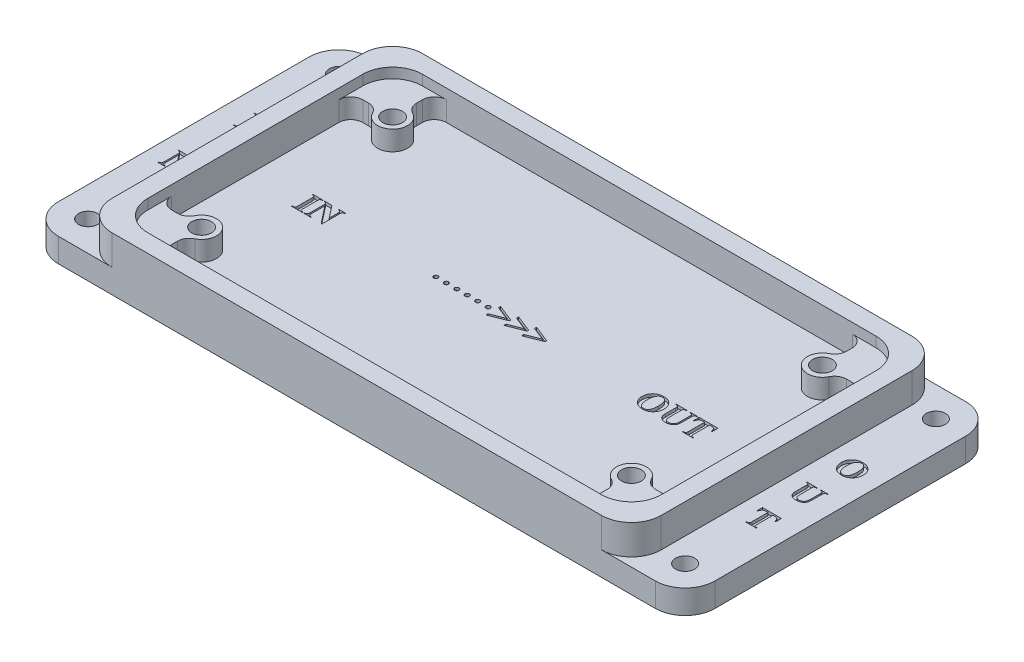
from build123d import *

# Parameters (mm, degrees)
SKETCH_1_W          = 92
SKETCH_1_H          = 52
SKETCH_1_W_2        = 86
SKETCH_1_H_2        = 46
EXTRUDE_1_DEPTH     = 5
SKETCH_2_R          = 1.65
EXTRUDE_3_DEPTH     = 5
FILLET_1_R          = 2
FILLET_2_R          = 5
SKETCH_3_W          = 86
SKETCH_3_H          = 46
CUT_EXTRUDE_1_DEPTH = 1.7
SKETCH_5_W          = 110
SKETCH_5_H          = 52
SKETCH_5_R          = 1.6
EXTRUDE_4_DEPTH     = 4
SKETCH_6_R          = 3
CUT_EXTRUDE_2_DEPTH = 3
FILLET_3_R          = 5
CUT_EXTRUDE_3_DEPTH = 0.5
SKETCH_8_R          = 1.65
CUT_EXTRUDE_4_DEPTH = 62.040969981


with BuildPart() as part:
    # 草图1 → 凸台-拉伸1 (new body)
    with BuildSketch(Plane(origin=(0, 0, 0), x_dir=(1, 0, 0), z_dir=(0, 1, 0))):
        Rectangle(SKETCH_1_W, SKETCH_1_H)
        Rectangle(SKETCH_1_W_2, SKETCH_1_H_2, mode=Mode.SUBTRACT)
    extrude(amount=EXTRUDE_1_DEPTH)

    # 草图2 → 凸台-拉伸3 (add)
    # profile 1 of 4: a face of its own
    with BuildSketch(Plane.XZ):
        with BuildLine():
            Line((43, 23), (36, 23))
            Line((36, 23), (36, 18.5))
            ThreePointArc((36, 18.5), (34.232233047, 14.232233047), (38.5, 16))
            Line((38.5, 16), (43, 16))
            Line((43, 16), (43, 23))
        make_face()
        with Locations(Location((36, 16, 0), (0, 0, 270))):
            Circle(SKETCH_2_R, mode=Mode.SUBTRACT)
    # profile 2 of 4: a face of its own
    with BuildSketch(Plane.XZ):
        with BuildLine():
            Line((36, -18.5), (36, -23))
            Line((36, -23), (43, -23))
            Line((43, -23), (43, -16))
            Line((43, -16), (38.5, -16))
            ThreePointArc((38.5, -16), (34.232233047, -14.232233047), (36, -18.5))
        make_face()
        with Locations(Location((36, -16, 0), (0, 0, 270))):
            Circle(SKETCH_2_R, mode=Mode.SUBTRACT)
    # profile 3 of 4: a face of its own
    with BuildSketch(Plane.XZ):
        with BuildLine():
            Line((-38.5, -16), (-43, -16))
            Line((-43, -16), (-43, -23))
            Line((-43, -23), (-36, -23))
            Line((-36, -23), (-36, -18.5))
            ThreePointArc((-36, -18.5), (-34.232233047, -14.232233047), (-38.5, -16))
        make_face()
        with Locations(Location((-36, -16, 0), (0, 0, 270))):
            Circle(SKETCH_2_R, mode=Mode.SUBTRACT)
    # profile 4 of 4: a face of its own
    with BuildSketch(Plane.XZ):
        with BuildLine():
            Line((-43, 16), (-38.5, 16))
            ThreePointArc((-38.5, 16), (-34.232233047, 14.232233047), (-36, 18.5))
            Line((-36, 18.5), (-36, 23))
            Line((-36, 23), (-43, 23))
            Line((-43, 23), (-43, 16))
        make_face()
        with BuildLine():
            ThreePointArc((-36, 17.65), (-34.833273811, 17.166726189), (-34.35, 16))
            ThreePointArc((-34.35, 16), (-37.166726189, 14.833273811), (-36, 17.65))
        make_face(mode=Mode.SUBTRACT)
    extrude(amount=-EXTRUDE_3_DEPTH)

    # 圆角1
    fillet_1_edges = [part.edges().sort_by_distance(p)[0] for p in [
        (-38.5, 2.5, 16),
        (-43, 2.5, 16),
        (-36, 2.5, 23),
        (-36, 2.5, 18.5),
        (-36, 2.5, -18.5),
        (-36, 2.5, -23),
        (-43, 2.5, -16),
        (-38.5, 2.5, -16),
        (38.5, 2.5, -16),
        (43, 2.5, -16),
        (36, 2.5, -23),
        (36, 2.5, -18.5),
        (36, 2.5, 18.5),
        (36, 2.5, 23),
        (43, 2.5, 16),
        (38.5, 2.5, 16),
    ]]
    fillet(fillet_1_edges, radius=FILLET_1_R)

    # 圆角2
    fillet_2_edges = [part.edges().sort_by_distance(p)[0] for p in [
        (46, 2.5, -26),
        (46, 2.5, 26),
        (-46, 2.5, 26),
        (-46, 2.5, -26),
    ]]
    fillet(fillet_2_edges, radius=FILLET_2_R)

    # 草图3 → 切除-拉伸1 (cut)
    with BuildSketch(Plane(origin=(0, 5, 0), x_dir=(1, 0, 0), z_dir=(0, 1, 0))):
        Rectangle(SKETCH_3_W, SKETCH_3_H)
    extrude(amount=-CUT_EXTRUDE_1_DEPTH, mode=Mode.SUBTRACT)

    # 草图5 → 凸台-拉伸4 (add)
    with BuildSketch(Plane.XZ):
        Rectangle(SKETCH_5_W, SKETCH_5_H)
        with Locations(Location((-50, 21, 0), (0, 0, 270))):
            Circle(SKETCH_5_R, mode=Mode.SUBTRACT)
        with Locations(Location((-50, -21, 0), (0, 0, 270))):
            Circle(SKETCH_5_R, mode=Mode.SUBTRACT)
        with Locations(Location((50, -21, 0), (0, 0, 270))):
            Circle(SKETCH_5_R, mode=Mode.SUBTRACT)
        with Locations(Location((50, 21, 0), (0, 0, 270))):
            Circle(SKETCH_5_R, mode=Mode.SUBTRACT)
    extrude(amount=EXTRUDE_4_DEPTH)

    # 草图6 → 切除-拉伸2 (cut)
    with BuildSketch(Plane.XZ.offset(4)):
        with Locations(Location((-36, 16, 0), (0, 0, 270))):
            Circle(SKETCH_6_R)
        with Locations(Location((-36, -16, 0), (0, 0, 270))):
            Circle(SKETCH_6_R)
        with Locations(Location((36, -16, 0), (0, 0, 270))):
            Circle(SKETCH_6_R)
        with Locations(Location((36, 16, 0), (0, 0, 270))):
            Circle(SKETCH_6_R)
    extrude(amount=-CUT_EXTRUDE_2_DEPTH, mode=Mode.SUBTRACT)

    # 圆角3
    fillet_3_edges = [part.edges().sort_by_distance(p)[0] for p in [
        (43, 4.15, -23),
        (43, 4.15, 23),
        (-43, 4.15, 23),
        (-43, 4.15, -23),
        (55, -2, -26),
        (55, -2, 26),
        (-55, -2, 26),
        (-55, -2, -26),
    ]]
    fillet(fillet_3_edges, radius=FILLET_3_R)

    # 草图7 → 切除-拉伸3 (cut)
    # profile 1 of 19: a face of its own
    with BuildSketch(Plane(origin=(0, 0, 0), x_dir=(1, 0, 0), z_dir=(0, 1, 0))):
        with BuildLine():
            Line((-49.64597424, 4.876015985), (-49.64597424, 4.778793763))
            Line((-49.64597424, 4.778793763), (-51.444585351, 4.778793763))
            Line((-51.444585351, 4.778793763), (-51.444585351, 4.876015985))
            Line((-51.444585351, 4.876015985), (-51.329893511, 4.876015985))
            add(Edge.make_bspline(
                [(-51.329893511, 4.876015985), (-51.306049854, 4.876461375), (-51.260664938, 4.877309148), (-51.196166444, 4.887384821), (-51.138593177, 4.903341619), (-51.104605299, 4.920311985), (-51.088357053, 4.928424839)],
                knots=[0, 0, 0, 0, 1.144467932, 2.17842344, 3.129177061, 4, 4, 4, 4], degree=3))
            add(Edge.make_bspline(
                [(-51.088357053, 4.928424839), (-51.077682569, 4.93486423), (-51.056090546, 4.947889636), (-51.028359682, 4.975480981), (-51.004859905, 5.009114491), (-50.992795535, 5.034559546), (-50.986577539, 5.047673971)],
                knots=[0, 0, 0, 0, 0.93343552, 1.888125192, 2.911536119, 4, 4, 4, 4], degree=3))
            add(Edge.make_bspline(
                [(-50.986577539, 5.047673971), (-50.98409666, 5.053690214), (-50.978445319, 5.067394974), (-50.974243547, 5.091971632), (-50.968150891, 5.121887434), (-50.965076377, 5.158290125), (-50.961974832, 5.200809371), (-50.959557239, 5.249182981), (-50.9593037, 5.303643651), (-50.958761497, 5.34187322), (-50.95847424, 5.362127096)],
                knots=[0, 0, 0, 0, 0.491154816, 1.118830903, 1.878082211, 2.802823963, 3.878617243, 5.106317376, 6.466938293, 8, 8, 8, 8], degree=3))
            Line((-50.95847424, 5.362127096), (-50.95847424, 7.695460429))
            add(Edge.make_bspline(
                [(-50.95847424, 7.695460429), (-50.958764886, 7.715967353), (-50.959321065, 7.755209279), (-50.959526399, 7.810937508), (-50.961994424, 7.8605718), (-50.965031198, 7.903863756), (-50.968345973, 7.941480344), (-50.9740557, 7.972746866), (-50.978590472, 7.998473468), (-50.988148546, 8.024234974), (-51.003371126, 8.052386992), (-51.02916782, 8.082059648), (-51.061554477, 8.109471196), (-51.100594599, 8.134747562), (-51.147157879, 8.156227835), (-51.201559066, 8.170892315), (-51.263244047, 8.180142628), (-51.306816228, 8.181076781), (-51.329893511, 8.18157154)],
                knots=[0, 0, 0, 0, 1.353963977, 2.590937397, 3.678525439, 4.633585292, 5.456840327, 6.168525469, 6.732370981, 7.176481794, 7.976852204, 8.830756602, 9.755347706, 10.770665926, 11.892520065, 13.125421506, 14.477527201, 16, 16, 16, 16], degree=3))
            Line((-51.329893511, 8.18157154), (-51.444585351, 8.18157154))
            Line((-51.444585351, 8.18157154), (-51.444585351, 8.278793763))
            Line((-51.444585351, 8.278793763), (-49.64597424, 8.278793763))
            Line((-49.64597424, 8.278793763), (-49.64597424, 8.18157154))
            Line((-49.64597424, 8.18157154), (-49.759906532, 8.18157154))
            add(Edge.make_bspline(
                [(-49.759906532, 8.18157154), (-49.783747478, 8.181116838), (-49.829127235, 8.18025134), (-49.893420048, 8.170332712), (-49.950650556, 8.1540854), (-49.984430507, 8.137258706), (-50.000683442, 8.129162686)],
                knots=[0, 0, 0, 0, 1.147815573, 2.184795468, 3.126629849, 4, 4, 4, 4], degree=3))
            add(Edge.make_bspline(
                [(-50.000683442, 8.129162686), (-50.011368317, 8.122731311), (-50.032981359, 8.10972212), (-50.060652739, 8.081898682), (-50.084967088, 8.048557785), (-50.097520551, 8.023045304), (-50.103982053, 8.009913554)],
                knots=[0, 0, 0, 0, 0.928829741, 1.878808762, 2.908183361, 4, 4, 4, 4], degree=3))
            add(Edge.make_bspline(
                [(-50.103982053, 8.009913554), (-50.106451535, 8.003895077), (-50.111982867, 7.99041444), (-50.11652263, 7.96591079), (-50.122292286, 7.935931054), (-50.125517377, 7.899303534), (-50.128546567, 7.857027922), (-50.131038796, 7.808659663), (-50.131241399, 7.754196509), (-50.131794335, 7.715714135), (-50.132085351, 7.695460429)],
                knots=[0, 0, 0, 0, 0.491143652, 1.100100526, 1.878201893, 2.802922625, 3.87869145, 5.087223688, 6.466973141, 8, 8, 8, 8], degree=3))
            Line((-50.132085351, 7.695460429), (-50.132085351, 5.362127096))
            add(Edge.make_bspline(
                [(-50.132085351, 5.362127096), (-50.131804223, 5.341619544), (-50.131266257, 5.302376416), (-50.130938335, 5.246656279), (-50.128857611, 5.196976447), (-50.124602899, 5.153492573), (-50.121218512, 5.115945391), (-50.116841537, 5.084163547), (-50.111077712, 5.05870672), (-50.101944686, 5.032566045), (-50.085201224, 5.005346201), (-50.05999445, 4.975462263), (-50.027448734, 4.948136419), (-49.988457453, 4.922833736), (-49.941879057, 4.90136161), (-49.887482468, 4.886694642), (-49.826047126, 4.877482583), (-49.782729792, 4.876522067), (-49.759906532, 4.876015985)],
                knots=[0, 0, 0, 0, 1.354319329, 2.591617395, 3.679490877, 4.636117144, 5.476222309, 6.168990776, 6.752950479, 7.19717785, 7.991448918, 8.845577426, 9.770411191, 10.785995884, 11.908144457, 13.141369476, 14.493830035, 16, 16, 16, 16], degree=3))
            Line((-49.759906532, 4.876015985), (-49.64597424, 4.876015985))
        make_face()
    # profile 2 of 19: a face of its own
    with BuildSketch(Plane(origin=(0, 0, 0), x_dir=(1, 0, 0), z_dir=(0, 1, 0))):
        with BuildLine():
            Line((-51.181579149, -3.436958688), (-49.550068732, -5.50824775))
            Line((-49.550068732, -5.50824775), (-49.550068732, -4.117514243))
            add(Edge.make_bspline(
                [(-49.550068732, -4.117514243), (-49.550419381, -4.091687673), (-49.551090138, -4.042283872), (-49.554500658, -3.971523669), (-49.561667787, -3.907465532), (-49.569974137, -3.849372556), (-49.583207627, -3.79830251), (-49.597356088, -3.753336739), (-49.614461953, -3.714704959), (-49.629502735, -3.692740741), (-49.636657274, -3.682292889)],
                knots=[0, 0, 0, 0, 1.37708922, 2.634242248, 3.774587307, 4.813165717, 5.759297908, 6.583135444, 7.326031535, 8, 8, 8, 8], degree=3))
            add(Edge.make_bspline(
                [(-49.636657274, -3.682292889), (-49.647232024, -3.670089905), (-49.668412749, -3.645647905), (-49.706154025, -3.614182286), (-49.749027006, -3.588360494), (-49.796892737, -3.567768523), (-49.84966549, -3.551952225), (-49.907383097, -3.540587559), (-49.970225377, -3.534677671), (-50.013635077, -3.534350714), (-50.036179843, -3.53418091)],
                knots=[0, 0, 0, 0, 0.876036587, 1.754659902, 2.655600339, 3.585565811, 4.577428142, 5.642743129, 6.775761992, 8, 8, 8, 8], degree=3))
            Line((-50.036179843, -3.53418091), (-50.036179843, -3.436958688))
            Line((-50.036179843, -3.436958688), (-48.820902065, -3.436958688))
            Line((-48.820902065, -3.436958688), (-48.820902065, -3.53418091))
            add(Edge.make_bspline(
                [(-48.820902065, -3.53418091), (-48.856939229, -3.538716568), (-48.922744868, -3.546998903), (-49.011173867, -3.565465385), (-49.080980481, -3.58414477), (-49.134543959, -3.606387057), (-49.175480555, -3.635122229), (-49.20898822, -3.670140286), (-49.238954726, -3.711624134), (-49.265099771, -3.762151745), (-49.28494561, -3.826216595), (-49.29740975, -3.906955877), (-49.305512014, -4.005949165), (-49.306484864, -4.078250489), (-49.307013176, -4.117514243)],
                knots=[0, 0, 0, 0, 1.47293099, 2.689644668, 3.661742309, 4.402208035, 5.02909861, 5.67554278, 6.359727415, 7.099337769, 7.973129416, 9.067356349, 10.407406766, 12, 12, 12, 12], degree=3))
            Line((-49.307013176, -4.117514243), (-49.307013176, -6.985569799))
            Line((-49.307013176, -6.985569799), (-49.418666822, -6.985569799))
            Line((-49.418666822, -6.985569799), (-51.688957621, -4.101563722))
            Line((-51.688957621, -4.101563722), (-51.688957621, -6.353625354))
            add(Edge.make_bspline(
                [(-51.688957621, -6.353625354), (-51.688399708, -6.376417543), (-51.687325736, -6.420292106), (-51.682554359, -6.483340998), (-51.672632631, -6.540494645), (-51.659047706, -6.591915069), (-51.64175217, -6.637619617), (-51.620674328, -6.677939589), (-51.594366795, -6.711512468), (-51.555757652, -6.749149269), (-51.500792646, -6.784760917), (-51.430438299, -6.816817436), (-51.355310578, -6.836516527), (-51.303475244, -6.838655579), (-51.277282274, -6.839736465)],
                knots=[0, 0, 0, 0, 1.127047964, 2.169547561, 3.122229636, 3.990523395, 4.794755099, 5.533929617, 6.229880341, 6.893690072, 8.19195966, 9.44115978, 10.706989644, 12, 12, 12, 12], degree=3))
            Line((-51.277282274, -6.839736465), (-51.20284651, -6.839736465))
            Line((-51.20284651, -6.839736465), (-51.20284651, -6.936958688))
            Line((-51.20284651, -6.936958688), (-52.418124288, -6.936958688))
            Line((-52.418124288, -6.936958688), (-52.418124288, -6.839736465))
            add(Edge.make_bspline(
                [(-52.418124288, -6.839736465), (-52.396339331, -6.839211314), (-52.354476418, -6.838202161), (-52.294064903, -6.832983138), (-52.238598089, -6.824236762), (-52.188522091, -6.810957927), (-52.143142516, -6.796287835), (-52.103175806, -6.777299988), (-52.068738602, -6.754130235), (-52.038457206, -6.728205613), (-52.012817272, -6.697554248), (-51.990816149, -6.662570094), (-51.972621203, -6.622349619), (-51.957570992, -6.577836776), (-51.946264328, -6.528434122), (-51.938172682, -6.474605229), (-51.932562449, -6.415771815), (-51.932201271, -6.374907033), (-51.932013176, -6.353625354)],
                knots=[0, 0, 0, 0, 1.302254148, 2.502467739, 3.622024049, 4.653421555, 5.596190003, 6.46934253, 7.287800068, 8.07079221, 8.843923894, 9.666846287, 10.533548967, 11.476317415, 12.471093534, 13.558375583, 14.728443775, 16, 16, 16, 16], degree=3))
            Line((-51.932013176, -6.353625354), (-51.932013176, -3.793946535))
            Line((-51.932013176, -3.793946535), (-51.97378835, -3.741537681))
            add(Edge.make_bspline(
                [(-51.97378835, -3.741537681), (-51.991194314, -3.722245185), (-52.023973278, -3.685913499), (-52.074568334, -3.639587545), (-52.1221419, -3.603952989), (-52.168163344, -3.576794262), (-52.218070352, -3.559320576), (-52.274388376, -3.545146585), (-52.340233541, -3.537808897), (-52.3872257, -3.535434902), (-52.412047899, -3.53418091)],
                knots=[0, 0, 0, 0, 1.235439228, 2.326582838, 3.256262787, 4.059856782, 4.856199611, 5.761619077, 6.817642388, 8, 8, 8, 8], degree=3))
            Line((-52.412047899, -3.53418091), (-52.412047899, -3.436958688))
            Line((-52.412047899, -3.436958688), (-51.181579149, -3.436958688))
        make_face()
    # profile 3 of 19: a face of its own
    with BuildSketch(Plane(origin=(0, 0, 0), x_dir=(1, 0, 0), z_dir=(0, 1, 0))):
        with BuildLine():
            add(Edge.make_bspline(
                [(50.217896868, 8.53294439), (50.285534403, 8.533998996), (50.417802401, 8.53606132), (50.611835373, 8.517014725), (50.796286388, 8.48246127), (50.971258652, 8.431120552), (51.135772734, 8.361144222), (51.291086409, 8.274948795), (51.436578512, 8.171280147), (51.570482443, 8.051273249), (51.691106708, 7.919076052), (51.797603356, 7.777926684), (51.887682571, 7.628598444), (51.96095184, 7.470893059), (52.018404435, 7.305295943), (52.05809037, 7.13131034), (52.083208344, 6.949510674), (52.086320521, 6.825562974), (52.087905549, 6.762436578)],
                knots=[0, 0, 0, 0, 1.117599178, 2.185511443, 3.216596641, 4.216496892, 5.193720437, 6.166199278, 7.147635958, 8.140749636, 9.133263309, 10.101842832, 11.059452728, 12.010747998, 12.971773146, 13.951566087, 14.956735376, 16, 16, 16, 16], degree=3))
            add(Edge.make_bspline(
                [(52.087905549, 6.762436578), (52.086769367, 6.70820425), (52.08452758, 6.601199002), (52.06577476, 6.443181211), (52.035220701, 6.290139462), (51.993869572, 6.141440432), (51.938840552, 5.998169809), (51.871257274, 5.860410322), (51.79369081, 5.726307119), (51.731758547, 5.643056877), (51.700535757, 5.601086752)],
                knots=[0, 0, 0, 0, 1.043246653, 2.058419255, 3.056808262, 4.043829632, 5.024555343, 6.005002729, 6.994233708, 8, 8, 8, 8], degree=3))
            add(Edge.make_bspline(
                [(51.700535757, 5.601086752), (51.678837748, 5.573967576), (51.635862933, 5.520255664), (51.566087584, 5.445192116), (51.494448656, 5.373993532), (51.417814274, 5.309689342), (51.339018097, 5.249438406), (51.256667778, 5.194455897), (51.170783524, 5.145225347), (51.081782515, 5.101004537), (50.989312697, 5.062336357), (50.893955857, 5.027818603), (50.794515255, 5.000087633), (50.692189339, 4.976383409), (50.58643418, 4.958151929), (50.477631819, 4.945667015), (50.365656552, 4.936545422), (50.289820092, 4.935999393), (50.251317007, 4.935722168)],
                knots=[0, 0, 0, 0, 1.00627325, 1.9930127, 2.968556301, 3.931628562, 4.889992766, 5.842467438, 6.799060146, 7.757311971, 8.720859362, 9.702647782, 10.694476427, 11.710892394, 12.745970349, 13.802697082, 14.884402792, 16, 16, 16, 16], degree=3))
            add(Edge.make_bspline(
                [(50.251317007, 4.935722168), (50.212818586, 4.936074742), (50.136756707, 4.936771328), (50.024259202, 4.944868587), (49.914953532, 4.956609972), (49.808927881, 4.974031893), (49.706517676, 4.997373192), (49.606661111, 5.023076723), (49.51105479, 5.056211923), (49.41863304, 5.093720964), (49.329009651, 5.135075458), (49.242975368, 5.182273039), (49.160854024, 5.235030388), (49.081765575, 5.29209998), (49.005483476, 5.35346889), (48.933248746, 5.42078951), (48.86402446, 5.49283341), (48.820810142, 5.544128212), (48.799060062, 5.569945258)],
                knots=[0, 0, 0, 0, 1.12499151, 2.222661784, 3.294793131, 4.33735381, 5.360698186, 6.364076506, 7.349253377, 8.315262806, 9.278632822, 10.232406028, 11.180767221, 12.129590213, 13.081869556, 14.040110377, 15.013573345, 16, 16, 16, 16], degree=3))
            add(Edge.make_bspline(
                [(48.799060062, 5.569945258), (48.766652664, 5.61219527), (48.702197779, 5.69622607), (48.61953496, 5.831033013), (48.550054907, 5.97179367), (48.492945071, 6.118190934), (48.447962239, 6.270349394), (48.416185799, 6.428427403), (48.396650267, 6.592309533), (48.394534897, 6.703643273), (48.393461104, 6.760157932)],
                knots=[0, 0, 0, 0, 0.995754374, 1.980450006, 2.952842694, 3.929288476, 4.917067138, 5.917621276, 6.942953664, 8, 8, 8, 8], degree=3))
            add(Edge.make_bspline(
                [(48.393461104, 6.760157932), (48.395088109, 6.823274968), (48.398282709, 6.947204288), (48.422820424, 7.129252742), (48.464748838, 7.302943907), (48.522804777, 7.468835718), (48.596570305, 7.626937875), (48.687583855, 7.776617889), (48.795616831, 7.917837911), (48.91868612, 8.049640823), (49.053239234, 8.169454928), (49.196837859, 8.274058174), (49.348792677, 8.359882015), (49.50796951, 8.429774835), (49.674779263, 8.482314937), (49.849467294, 8.516946304), (50.031383745, 8.536008407), (50.155067132, 8.53397655), (50.217896868, 8.53294439)],
                knots=[0, 0, 0, 0, 1.060255294, 2.081794832, 3.079505486, 4.0575798, 5.030022739, 6.005429218, 6.99491703, 8.012249652, 9.030720031, 10.017772549, 10.991257006, 11.957043232, 12.933793802, 13.923226749, 14.945023109, 16, 16, 16, 16], degree=3))
        make_face()
        with BuildLine():
            add(Edge.make_bspline(
                [(50.248278812, 8.338499946), (50.209413248, 8.337151406), (50.133510609, 8.33451777), (50.023613939, 8.310638718), (49.920589836, 8.273771546), (49.825179051, 8.220002107), (49.736378187, 8.15227328), (49.656294111, 8.067763315), (49.582855074, 7.969289246), (49.541819962, 7.895702579), (49.520631243, 7.857705675)],
                knots=[0, 0, 0, 0, 1.010341478, 1.973149883, 2.913323355, 3.848402755, 4.811842333, 5.809142135, 6.868737798, 8, 8, 8, 8], degree=3))
            add(Edge.make_bspline(
                [(49.520631243, 7.857705675), (49.503997116, 7.823308033), (49.469568827, 7.752113917), (49.429851983, 7.636104839), (49.394617606, 7.510119806), (49.365970485, 7.373361913), (49.344349782, 7.225696721), (49.328667976, 7.067539235), (49.318471084, 6.898782791), (49.317547673, 6.782706716), (49.317072215, 6.72294005)],
                knots=[0, 0, 0, 0, 0.787943638, 1.630837067, 2.525905988, 3.487208031, 4.51219802, 5.604605297, 6.766629954, 8, 8, 8, 8], degree=3))
            add(Edge.make_bspline(
                [(49.317072215, 6.72294005), (49.317732785, 6.652015583), (49.319010763, 6.514800782), (49.334847806, 6.316309357), (49.358379528, 6.132040134), (49.392294228, 5.962132673), (49.436165378, 5.806293796), (49.489754126, 5.66473573), (49.553094136, 5.536786244), (49.605311017, 5.461037872), (49.630765792, 5.424111925)],
                knots=[0, 0, 0, 0, 1.253361503, 2.424829634, 3.517270749, 4.535371114, 5.484506921, 6.375489106, 7.20808062, 8, 8, 8, 8], degree=3))
            add(Edge.make_bspline(
                [(49.630765792, 5.424111925), (49.649455011, 5.400576044), (49.685983846, 5.354574213), (49.749600018, 5.294740211), (49.817885864, 5.243051819), (49.893148162, 5.202569198), (49.972475489, 5.169028444), (50.057894402, 5.146602421), (50.148564634, 5.132610692), (50.211007357, 5.130993962), (50.242961972, 5.130166613)],
                knots=[0, 0, 0, 0, 1.020058884, 1.99374635, 2.959073536, 3.921751619, 4.889988268, 5.879249688, 6.914721236, 8, 8, 8, 8], degree=3))
            add(Edge.make_bspline(
                [(50.242961972, 5.130166613), (50.285396442, 5.131338385), (50.367478201, 5.133604967), (50.484699003, 5.159178468), (50.592504142, 5.197253106), (50.655009146, 5.237298081), (50.685778812, 5.257011231)],
                knots=[0, 0, 0, 0, 1.086516288, 2.101667992, 3.065498145, 4, 4, 4, 4], degree=3))
            add(Edge.make_bspline(
                [(50.685778812, 5.257011231), (50.7042525, 5.271142314), (50.741795969, 5.299860452), (50.794403225, 5.349305938), (50.842596379, 5.405965618), (50.888562481, 5.467712476), (50.930965339, 5.535645714), (50.970695302, 5.609307926), (51.005890069, 5.689686305), (51.039869274, 5.775503868), (51.068987734, 5.868253884), (51.095338935, 5.96746959), (51.115662377, 6.073720941), (51.134536577, 6.186294128), (51.147614509, 6.305755885), (51.157777065, 6.431878211), (51.16262179, 6.564916982), (51.163727769, 6.655844076), (51.164294437, 6.702432238)],
                knots=[0, 0, 0, 0, 0.707878774, 1.438598863, 2.192768746, 2.969795667, 3.780358143, 4.628744544, 5.515519471, 6.450279976, 7.437595481, 8.473401936, 9.573958948, 10.729714514, 11.947871327, 13.231394215, 14.581454142, 16, 16, 16, 16], degree=3))
            add(Edge.make_bspline(
                [(51.164294437, 6.702432238), (51.163829141, 6.757378843), (51.16292827, 6.863762097), (51.156820193, 7.018013924), (51.147103472, 7.161647767), (51.13373747, 7.294720192), (51.115994877, 7.417007568), (51.092622028, 7.528316703), (51.067891649, 7.629447857), (51.036903575, 7.720012887), (51.00280396, 7.801662298), (50.968434123, 7.877524302), (50.930003575, 7.946278734), (50.891161366, 8.010046353), (50.848079521, 8.066010135), (50.804157109, 8.117012004), (50.756935095, 8.160847446), (50.692185935, 8.2114727), (50.605562291, 8.263216261), (50.492945414, 8.30640186), (50.373198774, 8.33441617), (50.290467059, 8.337120764), (50.248278812, 8.338499946)],
                knots=[0, 0, 0, 0, 1.564715362, 3.029477591, 4.395383686, 5.663787164, 6.837420581, 7.912070591, 8.901835802, 9.800165859, 10.634314221, 11.421391877, 12.170015688, 12.876189058, 13.5452815, 14.178775877, 14.79090283, 15.376466922, 16.517763855, 17.647800425, 18.800518316, 20, 20, 20, 20], degree=3))
        make_face(mode=Mode.SUBTRACT)
    # profile 4 of 19: a face of its own
    with BuildSketch(Plane(origin=(0, 0, 0), x_dir=(1, 0, 0), z_dir=(0, 1, 0))):
        with BuildLine():
            Line((48.296238882, 1.053777724), (50.094849993, 1.053777724))
            Line((50.094849993, 1.053777724), (50.094849993, 0.956555502))
            Line((50.094849993, 0.956555502), (50.009021, 0.956555502))
            add(Edge.make_bspline(
                [(50.009021, 0.956555502), (49.979122326, 0.956302635), (49.924523646, 0.955840869), (49.850072841, 0.948267143), (49.790449859, 0.937110345), (49.74390545, 0.92044321), (49.708884157, 0.897733502), (49.680541798, 0.872302625), (49.656270467, 0.843882217), (49.640447552, 0.816126574), (49.631265654, 0.789047086), (49.625500886, 0.762284758), (49.620485001, 0.729290429), (49.615631578, 0.689809051), (49.613136242, 0.644145606), (49.610742949, 0.59199245), (49.609295638, 0.533493918), (49.608931159, 0.492218717), (49.608738882, 0.47044439)],
                knots=[0, 0, 0, 0, 1.873611657, 3.421446737, 4.685315238, 5.669949158, 6.497780211, 7.284732133, 8.050919915, 8.832571355, 9.269293487, 9.839173886, 10.546366176, 11.361468866, 12.331797416, 13.412206959, 14.634835235, 16, 16, 16, 16], degree=3))
            Line((49.608738882, 0.47044439), (49.608738882, -1.264364637))
            add(Edge.make_bspline(
                [(49.608738882, -1.264364637), (49.608715959, -1.302347229), (49.608672087, -1.375042912), (49.612945636, -1.47885297), (49.617864156, -1.572590666), (49.625221142, -1.656239581), (49.635288012, -1.729904644), (49.64587894, -1.79408344), (49.660249156, -1.847864593), (49.6812783, -1.906286303), (49.71680832, -1.968866607), (49.767746909, -2.037441121), (49.831085942, -2.098591051), (49.905000615, -2.152447561), (49.989398615, -2.198385834), (50.085965694, -2.228251027), (50.19167407, -2.249231405), (50.265885639, -2.250906541), (50.30448541, -2.251777832)],
                knots=[0, 0, 0, 0, 1.300992195, 2.489996405, 3.558512469, 4.516486413, 5.365297801, 6.105361831, 6.742819091, 7.269669067, 8.228349452, 9.194533075, 10.188122344, 11.230698299, 12.320957625, 13.461922122, 14.679865887, 16, 16, 16, 16], degree=3))
            add(Edge.make_bspline(
                [(50.30448541, -2.251777832), (50.348908528, -2.250218685), (50.435166799, -2.247191223), (50.559332245, -2.222497931), (50.673337645, -2.182046649), (50.777009724, -2.125692603), (50.867871708, -2.05316564), (50.949393337, -1.970397926), (51.014904606, -1.872708703), (51.061904319, -1.783007806), (51.091670195, -1.700979571), (51.111310809, -1.628059196), (51.12755625, -1.544766477), (51.141126386, -1.4509713), (51.151550462, -1.346807912), (51.158957705, -1.232046523), (51.163513282, -1.106668678), (51.164027133, -1.019540897), (51.164294437, -0.974217068)],
                knots=[0, 0, 0, 0, 1.208075288, 2.345771551, 3.428856258, 4.489532947, 5.539753161, 6.58248904, 7.637421869, 8.72819277, 9.329769644, 10.008360403, 10.78123502, 11.637693061, 12.586496199, 13.629118266, 14.766668491, 16, 16, 16, 16], degree=3))
            Line((51.164294437, -0.974217068), (51.164294437, 0.47044439))
            add(Edge.make_bspline(
                [(51.164294437, 0.47044439), (51.163875542, 0.503650824), (51.163102981, 0.564892882), (51.153643206, 0.649130693), (51.141110038, 0.718949717), (51.11876013, 0.774017242), (51.093148362, 0.817695709), (51.064722899, 0.853502399), (51.032679914, 0.882330754), (51.008359496, 0.895949646), (50.996434194, 0.90262755)],
                knots=[0, 0, 0, 0, 1.628272018, 3.002994269, 4.157936954, 5.094593422, 5.902138284, 6.635561567, 7.330959666, 8, 8, 8, 8], degree=3))
            add(Edge.make_bspline(
                [(50.996434194, 0.90262755), (50.975873715, 0.911108802), (50.931985354, 0.929212868), (50.857230177, 0.944374058), (50.771705069, 0.955638379), (50.71064061, 0.956237209), (50.678183326, 0.956555502)],
                knots=[0, 0, 0, 0, 0.819172695, 1.748604514, 2.8033271, 4, 4, 4, 4], degree=3))
            Line((50.678183326, 0.956555502), (50.678183326, 1.053777724))
            Line((50.678183326, 1.053777724), (51.893461104, 1.053777724))
            Line((51.893461104, 1.053777724), (51.893461104, 0.956555502))
            Line((51.893461104, 0.956555502), (51.822063535, 0.956555502))
            add(Edge.make_bspline(
                [(51.822063535, 0.956555502), (51.798974387, 0.956153724), (51.754299038, 0.955376322), (51.690614117, 0.944349092), (51.632526254, 0.92780063), (51.580553768, 0.904424862), (51.534840229, 0.87378141), (51.496699869, 0.835703682), (51.463478399, 0.791945414), (51.448473065, 0.758178048), (51.440770132, 0.740843696)],
                knots=[0, 0, 0, 0, 1.183120061, 2.289227139, 3.304431175, 4.275119626, 5.200974401, 6.11028159, 7.02992005, 8, 8, 8, 8], degree=3))
            add(Edge.make_bspline(
                [(51.440770132, 0.740843696), (51.435546675, 0.72601617), (51.423562059, 0.691996133), (51.414284471, 0.63125904), (51.408539288, 0.555892965), (51.407769589, 0.50059158), (51.407349993, 0.47044439)],
                knots=[0, 0, 0, 0, 0.687610812, 1.577643118, 2.679467964, 4, 4, 4, 4], degree=3))
            Line((51.407349993, 0.47044439), (51.407349993, -0.864082519))
            add(Edge.make_bspline(
                [(51.407349993, -0.864082519), (51.407021361, -0.913962049), (51.406387353, -1.010191274), (51.402610058, -1.148963024), (51.396612177, -1.276853661), (51.3884998, -1.394155462), (51.377530763, -1.500887441), (51.362771995, -1.596535953), (51.347375089, -1.681662927), (51.328163512, -1.757630979), (51.304627056, -1.828006995), (51.272534306, -1.894425783), (51.234823897, -1.960145844), (51.188477607, -2.023810335), (51.136480011, -2.08723466), (51.075588335, -2.147734044), (51.008781757, -2.208022272), (50.934885044, -2.266275845), (50.853792612, -2.320394511), (50.765174496, -2.367799402), (50.669145934, -2.40714134), (50.56608305, -2.43884141), (50.456145432, -2.463885561), (50.339166276, -2.482021542), (50.214800673, -2.492597318), (50.129556598, -2.494074181), (50.08573541, -2.494833387)],
                knots=[0, 0, 0, 0, 1.467844093, 2.831812955, 4.08493233, 5.235248227, 6.291710913, 7.241099964, 8.082787107, 8.836329886, 9.545547297, 10.262123183, 11.003298874, 11.772408823, 12.576590708, 13.414278216, 14.295372854, 15.223952147, 16.180709153, 17.16068275, 18.17626284, 19.229647179, 20.330345869, 21.491588469, 22.710507751, 24, 24, 24, 24], degree=3))
            add(Edge.make_bspline(
                [(50.08573541, -2.494833387), (50.049274946, -2.494262633), (49.978594305, -2.493156193), (49.875883267, -2.488453732), (49.779705718, -2.477911069), (49.689483353, -2.465957793), (49.605982398, -2.447979972), (49.528567054, -2.428003173), (49.45784223, -2.402900433), (49.413665846, -2.382962984), (49.392267528, -2.37330561)],
                knots=[0, 0, 0, 0, 1.233143948, 2.390518333, 3.475011742, 4.504190893, 5.466338132, 6.361429022, 7.206303014, 8, 8, 8, 8], degree=3))
            add(Edge.make_bspline(
                [(49.392267528, -2.37330561), (49.365254777, -2.359186463), (49.312451373, -2.331586942), (49.237815218, -2.285771738), (49.168852457, -2.237612692), (49.107828304, -2.184431417), (49.050641177, -2.130755385), (49.000433036, -2.073042541), (48.957387884, -2.011693436), (48.918300904, -1.948339808), (48.886816747, -1.879586784), (48.858216292, -1.806485058), (48.835242025, -1.72727656), (48.81527718, -1.642929921), (48.800217903, -1.552848884), (48.789741507, -1.457247839), (48.783770244, -1.355839909), (48.782832292, -1.286399367), (48.782349993, -1.250692762)],
                knots=[0, 0, 0, 0, 1.072795036, 2.097055156, 3.081442936, 4.029903069, 4.944023557, 5.841256263, 6.716841961, 7.580550424, 8.457767987, 9.374838938, 10.342169353, 11.35836906, 12.425185407, 13.555221897, 14.742885322, 16, 16, 16, 16], degree=3))
            Line((48.782349993, -1.250692762), (48.782349993, 0.47044439))
            add(Edge.make_bspline(
                [(48.782349993, 0.47044439), (48.782131375, 0.49221745), (48.781714425, 0.533743324), (48.780585668, 0.592776773), (48.777204314, 0.645417739), (48.774041712, 0.691364113), (48.768286913, 0.730810873), (48.762855023, 0.763966836), (48.755394866, 0.790695208), (48.744224443, 0.817713295), (48.72524894, 0.845081515), (48.697251116, 0.873819316), (48.662591524, 0.898926346), (48.61964118, 0.921152894), (48.563708414, 0.939103665), (48.490801517, 0.94991344), (48.399663433, 0.956440856), (48.332712573, 0.956515071), (48.296238882, 0.956555502)],
                knots=[0, 0, 0, 0, 1.241640786, 2.368074092, 3.365879334, 4.249471888, 4.992646898, 5.63827609, 6.16378018, 6.571345593, 7.300077646, 8.045353014, 8.850967868, 9.729118509, 10.792840363, 12.183643133, 13.920913603, 16, 16, 16, 16], degree=3))
            Line((48.296238882, 0.956555502), (48.296238882, 1.053777724))
        make_face()
    # profile 5 of 19: a face of its own
    with BuildSketch(Plane(origin=(0, 0, 0), x_dir=(1, 0, 0), z_dir=(0, 1, 0))):
        with BuildLine():
            Line((51.504572215, -6.376777832), (51.504572215, -7.349000054))
            Line((51.504572215, -7.349000054), (51.407349993, -7.349000054))
            add(Edge.make_bspline(
                [(51.407349993, -7.349000054), (51.394277296, -7.299204326), (51.369857958, -7.206187654), (51.32715319, -7.079265796), (51.282093714, -6.974628198), (51.23312485, -6.889932748), (51.17782643, -6.820326763), (51.114599601, -6.760786684), (51.042996263, -6.707542071), (50.989521111, -6.679635611), (50.962254507, -6.665406304)],
                knots=[0, 0, 0, 0, 1.457214957, 2.722026344, 3.787486567, 4.677495633, 5.483472642, 6.294659805, 7.130459019, 8, 8, 8, 8], degree=3))
            add(Edge.make_bspline(
                [(50.962254507, -6.665406304), (50.943683181, -6.658258628), (50.901475887, -6.642014012), (50.826221971, -6.629417629), (50.733827424, -6.621330694), (50.666312776, -6.620361053), (50.629572215, -6.619833387)],
                knots=[0, 0, 0, 0, 0.705326227, 1.603004102, 2.695587181, 4, 4, 4, 4], degree=3))
            Line((50.629572215, -6.619833387), (50.337905549, -6.619833387))
            Line((50.337905549, -6.619833387), (50.337905549, -9.293444498))
            add(Edge.make_bspline(
                [(50.337905549, -9.293444498), (50.338186679, -9.313952048), (50.33872465, -9.353195173), (50.339052541, -9.408915336), (50.341133363, -9.458595085), (50.345387772, -9.502079212), (50.348773077, -9.539625629), (50.353147417, -9.571409671), (50.358918631, -9.596860337), (50.368026277, -9.623022173), (50.384851915, -9.649962879), (50.409173211, -9.680371723), (50.441840615, -9.707386332), (50.480755728, -9.732754319), (50.527358724, -9.754199195), (50.581985941, -9.76897038), (50.643952132, -9.778067527), (50.687769484, -9.779042293), (50.710843917, -9.77955561)],
                knots=[0, 0, 0, 0, 1.352414483, 2.587972293, 3.674315684, 4.629596459, 5.468520019, 6.160314109, 6.743452474, 7.187055041, 7.980208969, 8.822448445, 9.745981434, 10.760137711, 11.880707985, 13.112198476, 14.47926954, 16, 16, 16, 16], degree=3))
            Line((50.710843917, -9.77955561), (50.82401666, -9.77955561))
            Line((50.82401666, -9.77955561), (50.82401666, -9.876777832))
            Line((50.82401666, -9.876777832), (49.025405549, -9.876777832))
            Line((49.025405549, -9.876777832), (49.025405549, -9.77955561))
            Line((49.025405549, -9.77955561), (49.13933784, -9.77955561))
            add(Edge.make_bspline(
                [(49.13933784, -9.77955561), (49.163178787, -9.779100907), (49.208558543, -9.778235409), (49.272851356, -9.768316782), (49.330081864, -9.752069469), (49.363861815, -9.735242775), (49.38011475, -9.727146755)],
                knots=[0, 0, 0, 0, 1.147815573, 2.184795468, 3.126629849, 4, 4, 4, 4], degree=3))
            add(Edge.make_bspline(
                [(49.38011475, -9.727146755), (49.390799625, -9.72071538), (49.412412667, -9.707706189), (49.440084048, -9.679882751), (49.464398396, -9.646541854), (49.47695186, -9.621029373), (49.483413361, -9.607897623)],
                knots=[0, 0, 0, 0, 0.928829741, 1.878808762, 2.908183361, 4, 4, 4, 4], degree=3))
            add(Edge.make_bspline(
                [(49.483413361, -9.607897623), (49.48589424, -9.60188138), (49.491545581, -9.58817662), (49.495747353, -9.563599963), (49.501840009, -9.533684161), (49.504914523, -9.497281469), (49.508016068, -9.454762224), (49.510433661, -9.406388613), (49.5106872, -9.351927943), (49.511229403, -9.313698374), (49.51151666, -9.293444498)],
                knots=[0, 0, 0, 0, 0.491154816, 1.118830903, 1.878082211, 2.802823963, 3.878617243, 5.106317376, 6.466938293, 8, 8, 8, 8], degree=3))
            Line((49.51151666, -9.293444498), (49.51151666, -6.619833387))
            Line((49.51151666, -6.619833387), (49.219849993, -6.619833387))
            add(Edge.make_bspline(
                [(49.219849993, -6.619833387), (49.191984238, -6.620228824), (49.138440823, -6.620988647), (49.06104374, -6.627939143), (48.989429104, -6.639172142), (48.923532583, -6.654815289), (48.86325928, -6.67525264), (48.809591029, -6.701317672), (48.760738052, -6.730495879), (48.732924053, -6.754617374), (48.719307458, -6.766426269)],
                knots=[0, 0, 0, 0, 1.253047779, 2.407702914, 3.491633713, 4.510764096, 5.450666339, 6.347071276, 7.190793839, 8, 8, 8, 8], degree=3))
            add(Edge.make_bspline(
                [(48.719307458, -6.766426269), (48.70143691, -6.784037237), (48.665581323, -6.819372002), (48.618675857, -6.879480132), (48.5758848, -6.944039132), (48.53839096, -7.014452471), (48.507052689, -7.090527411), (48.479259443, -7.171534283), (48.457263016, -7.258178527), (48.447210363, -7.318280515), (48.442072215, -7.349000054)],
                knots=[0, 0, 0, 0, 0.914922114, 1.835705892, 2.776354923, 3.739610741, 4.741925865, 5.776441286, 6.863486844, 8, 8, 8, 8], degree=3))
            Line((48.442072215, -7.349000054), (48.344849993, -7.349000054))
            Line((48.344849993, -7.349000054), (48.344849993, -6.376777832))
            Line((48.344849993, -6.376777832), (51.504572215, -6.376777832))
        make_face()
    # profile 6 of 19: a face of its own
    with BuildSketch(Plane(origin=(0, 0, 0), x_dir=(1, 0, 0), z_dir=(0, 1, 0))):
        with BuildLine():
            Line((-32.99727339, -2.009557824), (-32.99727339, -2.106780046))
            Line((-32.99727339, -2.106780046), (-34.795884501, -2.106780046))
            Line((-34.795884501, -2.106780046), (-34.795884501, -2.009557824))
            Line((-34.795884501, -2.009557824), (-34.681192661, -2.009557824))
            add(Edge.make_bspline(
                [(-34.681192661, -2.009557824), (-34.657349004, -2.009112433), (-34.611964087, -2.00826466), (-34.547465593, -1.998188987), (-34.489892327, -1.982232189), (-34.455904448, -1.965261823), (-34.439656202, -1.95714897)],
                knots=[0, 0, 0, 0, 1.144467932, 2.17842344, 3.129177061, 4, 4, 4, 4], degree=3))
            add(Edge.make_bspline(
                [(-34.439656202, -1.95714897), (-34.428981719, -1.950709578), (-34.407389696, -1.937684172), (-34.379658832, -1.910092827), (-34.356159054, -1.876459318), (-34.344094685, -1.851014262), (-34.337876688, -1.837899838)],
                knots=[0, 0, 0, 0, 0.93343552, 1.888125192, 2.911536119, 4, 4, 4, 4], degree=3))
            add(Edge.make_bspline(
                [(-34.337876688, -1.837899838), (-34.33539581, -1.831883594), (-34.329744468, -1.818178834), (-34.325542697, -1.793602177), (-34.319450041, -1.763686375), (-34.316375527, -1.727283684), (-34.313273982, -1.684764438), (-34.310856388, -1.636390827), (-34.31060285, -1.581930157), (-34.310060647, -1.543700588), (-34.30977339, -1.523446713)],
                knots=[0, 0, 0, 0, 0.491154816, 1.118830903, 1.878082211, 2.802823963, 3.878617243, 5.106317376, 6.466938293, 8, 8, 8, 8], degree=3))
            Line((-34.30977339, -1.523446713), (-34.30977339, 0.809886621))
            add(Edge.make_bspline(
                [(-34.30977339, 0.809886621), (-34.310064036, 0.830393544), (-34.310620215, 0.869635471), (-34.310825548, 0.9253637), (-34.313293574, 0.974997992), (-34.316330347, 1.018289947), (-34.319645122, 1.055906536), (-34.325354849, 1.087173058), (-34.329889622, 1.11289966), (-34.339447695, 1.138661166), (-34.354670276, 1.166813184), (-34.38046697, 1.196485839), (-34.412853626, 1.223897387), (-34.451893749, 1.249173753), (-34.498457029, 1.270654026), (-34.552858215, 1.285318507), (-34.614543196, 1.294568819), (-34.658115378, 1.295502973), (-34.681192661, 1.295997732)],
                knots=[0, 0, 0, 0, 1.353963977, 2.590937397, 3.678525439, 4.633585292, 5.456840327, 6.168525469, 6.732370981, 7.176481794, 7.976852204, 8.830756602, 9.755347706, 10.770665926, 11.892520065, 13.125421506, 14.477527201, 16, 16, 16, 16], degree=3))
            Line((-34.681192661, 1.295997732), (-34.795884501, 1.295997732))
            Line((-34.795884501, 1.295997732), (-34.795884501, 1.393219954))
            Line((-34.795884501, 1.393219954), (-32.99727339, 1.393219954))
            Line((-32.99727339, 1.393219954), (-32.99727339, 1.295997732))
            Line((-32.99727339, 1.295997732), (-33.111205682, 1.295997732))
            add(Edge.make_bspline(
                [(-33.111205682, 1.295997732), (-33.135046628, 1.295543029), (-33.180426385, 1.294677531), (-33.244719197, 1.284758904), (-33.301949705, 1.268511591), (-33.335729656, 1.251684898), (-33.351982591, 1.243588878)],
                knots=[0, 0, 0, 0, 1.147815573, 2.184795468, 3.126629849, 4, 4, 4, 4], degree=3))
            add(Edge.make_bspline(
                [(-33.351982591, 1.243588878), (-33.362667466, 1.237157503), (-33.384280508, 1.224148311), (-33.411951889, 1.196324873), (-33.436266237, 1.162983977), (-33.448819701, 1.137471495), (-33.455281202, 1.124339746)],
                knots=[0, 0, 0, 0, 0.928829741, 1.878808762, 2.908183361, 4, 4, 4, 4], degree=3))
            add(Edge.make_bspline(
                [(-33.455281202, 1.124339746), (-33.457750685, 1.118321269), (-33.463282017, 1.104840631), (-33.467821779, 1.080336982), (-33.473591435, 1.050357246), (-33.476816526, 1.013729725), (-33.479845716, 0.971454113), (-33.482337946, 0.923085855), (-33.482540549, 0.868622701), (-33.483093485, 0.830140326), (-33.483384501, 0.809886621)],
                knots=[0, 0, 0, 0, 0.491143652, 1.100100526, 1.878201893, 2.802922625, 3.87869145, 5.087223688, 6.466973141, 8, 8, 8, 8], degree=3))
            Line((-33.483384501, 0.809886621), (-33.483384501, -1.523446713))
            add(Edge.make_bspline(
                [(-33.483384501, -1.523446713), (-33.483103373, -1.543954264), (-33.482565407, -1.583197393), (-33.482237485, -1.63891753), (-33.480156761, -1.688597361), (-33.475902048, -1.732081235), (-33.472517661, -1.769628417), (-33.468140686, -1.801410262), (-33.462376861, -1.826867089), (-33.453243835, -1.853007764), (-33.436500373, -1.880227608), (-33.411293599, -1.910111545), (-33.378747884, -1.93743739), (-33.339756602, -1.962740073), (-33.293178206, -1.984212199), (-33.238781618, -1.998879166), (-33.177346275, -2.008091226), (-33.134028941, -2.009051742), (-33.111205682, -2.009557824)],
                knots=[0, 0, 0, 0, 1.354319329, 2.591617395, 3.679490877, 4.636117144, 5.476222309, 6.168990776, 6.752950479, 7.19717785, 7.991448918, 8.845577426, 9.770411191, 10.785995884, 11.908144457, 13.141369476, 14.493830035, 16, 16, 16, 16], degree=3))
            Line((-33.111205682, -2.009557824), (-32.99727339, -2.009557824))
        make_face()
    # profile 7 of 19: a face of its own
    with BuildSketch(Plane(origin=(0, 0, 0), x_dir=(1, 0, 0), z_dir=(0, 1, 0))):
        with BuildLine():
            Line((-31.566283807, 1.393219954), (-29.93477339, -0.678069108))
            Line((-29.93477339, -0.678069108), (-29.93477339, 0.712664399))
            add(Edge.make_bspline(
                [(-29.93477339, 0.712664399), (-29.935124038, 0.738490969), (-29.935794796, 0.78789477), (-29.939205315, 0.858654973), (-29.946372445, 0.922713109), (-29.954678795, 0.980806086), (-29.967912285, 1.031876131), (-29.982060746, 1.076841902), (-29.999166611, 1.115473683), (-30.014207393, 1.137437901), (-30.021361932, 1.147885753)],
                knots=[0, 0, 0, 0, 1.37708922, 2.634242248, 3.774587307, 4.813165717, 5.759297908, 6.583135444, 7.326031535, 8, 8, 8, 8], degree=3))
            add(Edge.make_bspline(
                [(-30.021361932, 1.147885753), (-30.031936682, 1.160088736), (-30.053117407, 1.184530736), (-30.090858683, 1.215996356), (-30.133731663, 1.241818148), (-30.181597395, 1.262410119), (-30.234370147, 1.278226417), (-30.292087755, 1.289591083), (-30.354930035, 1.295500971), (-30.398339735, 1.295827927), (-30.420884501, 1.295997732)],
                knots=[0, 0, 0, 0, 0.876036587, 1.754659902, 2.655600339, 3.585565811, 4.577428142, 5.642743129, 6.775761992, 8, 8, 8, 8], degree=3))
            Line((-30.420884501, 1.295997732), (-30.420884501, 1.393219954))
            Line((-30.420884501, 1.393219954), (-29.205606723, 1.393219954))
            Line((-29.205606723, 1.393219954), (-29.205606723, 1.295997732))
            add(Edge.make_bspline(
                [(-29.205606723, 1.295997732), (-29.241643887, 1.291462074), (-29.307449525, 1.283179739), (-29.395878525, 1.264713257), (-29.465685139, 1.246033872), (-29.519248617, 1.223791585), (-29.560185213, 1.195056413), (-29.593692878, 1.160038356), (-29.623659384, 1.118554507), (-29.649804429, 1.068026897), (-29.669650268, 1.003962047), (-29.682114408, 0.923222765), (-29.690216672, 0.824229477), (-29.691189521, 0.751928153), (-29.691717834, 0.712664399)],
                knots=[0, 0, 0, 0, 1.47293099, 2.689644668, 3.661742309, 4.402208035, 5.02909861, 5.67554278, 6.359727415, 7.099337769, 7.973129416, 9.067356349, 10.407406766, 12, 12, 12, 12], degree=3))
            Line((-29.691717834, 0.712664399), (-29.691717834, -2.155391157))
            Line((-29.691717834, -2.155391157), (-29.80337148, -2.155391157))
            Line((-29.80337148, -2.155391157), (-32.073662279, 0.728614919))
            Line((-32.073662279, 0.728614919), (-32.073662279, -1.523446713))
            add(Edge.make_bspline(
                [(-32.073662279, -1.523446713), (-32.073104366, -1.546238901), (-32.072030394, -1.590113465), (-32.067259017, -1.653162356), (-32.057337289, -1.710316003), (-32.043752363, -1.761736428), (-32.026456827, -1.807440976), (-32.005378986, -1.847760947), (-31.979071453, -1.881333826), (-31.940462309, -1.918970627), (-31.885497303, -1.954582275), (-31.815142956, -1.986638794), (-31.740015236, -2.006337885), (-31.688179901, -2.008476937), (-31.661986932, -2.009557824)],
                knots=[0, 0, 0, 0, 1.127047964, 2.169547561, 3.122229636, 3.990523395, 4.794755099, 5.533929617, 6.229880341, 6.893690072, 8.19195966, 9.44115978, 10.706989644, 12, 12, 12, 12], degree=3))
            Line((-31.661986932, -2.009557824), (-31.587551168, -2.009557824))
            Line((-31.587551168, -2.009557824), (-31.587551168, -2.106780046))
            Line((-31.587551168, -2.106780046), (-32.802828945, -2.106780046))
            Line((-32.802828945, -2.106780046), (-32.802828945, -2.009557824))
            add(Edge.make_bspline(
                [(-32.802828945, -2.009557824), (-32.781043988, -2.009032672), (-32.739181076, -2.008023519), (-32.678769561, -2.002804497), (-32.623302747, -1.99405812), (-32.573226749, -1.980779285), (-32.527847174, -1.966109193), (-32.487880464, -1.947121346), (-32.45344326, -1.923951594), (-32.423161864, -1.898026971), (-32.39752193, -1.867375606), (-32.375520807, -1.832391452), (-32.357325861, -1.792170977), (-32.34227565, -1.747658134), (-32.330968986, -1.69825548), (-32.32287734, -1.644426587), (-32.317267107, -1.585593173), (-32.316905929, -1.544728392), (-32.316717834, -1.523446713)],
                knots=[0, 0, 0, 0, 1.302254148, 2.502467739, 3.622024049, 4.653421555, 5.596190003, 6.46934253, 7.287800068, 8.07079221, 8.843923894, 9.666846287, 10.533548967, 11.476317415, 12.471093534, 13.558375583, 14.728443775, 16, 16, 16, 16], degree=3))
            Line((-32.316717834, -1.523446713), (-32.316717834, 1.036232107))
            Line((-32.316717834, 1.036232107), (-32.358493008, 1.088640961))
            add(Edge.make_bspline(
                [(-32.358493008, 1.088640961), (-32.375898972, 1.107933457), (-32.408677935, 1.144265143), (-32.459272992, 1.190591097), (-32.506846558, 1.226225653), (-32.552868002, 1.253384379), (-32.60277501, 1.270858066), (-32.659093034, 1.285032057), (-32.724938199, 1.292369744), (-32.771930358, 1.29474374), (-32.796752557, 1.295997732)],
                knots=[0, 0, 0, 0, 1.235439228, 2.326582838, 3.256262787, 4.059856782, 4.856199611, 5.761619077, 6.817642388, 8, 8, 8, 8], degree=3))
            Line((-32.796752557, 1.295997732), (-32.796752557, 1.393219954))
            Line((-32.796752557, 1.393219954), (-31.566283807, 1.393219954))
        make_face()
    # profile 8 of 19: a face of its own
    with BuildSketch(Plane(origin=(0, 0, 0), x_dir=(1, 0, 0), z_dir=(0, 1, 0))):
        with BuildLine():
            add(Edge.make_bspline(
                [(-12.459078945, 0.080719954), (-12.4346402, 0.079399328), (-12.386700745, 0.076808765), (-12.317684509, 0.056506686), (-12.254756382, 0.022080927), (-12.199382589, -0.024736776), (-12.153402273, -0.080400365), (-12.118661413, -0.142396493), (-12.098420546, -0.210722905), (-12.095820889, -0.258160903), (-12.094495612, -0.282344282)],
                knots=[0, 0, 0, 0, 1.025415426, 2.011472139, 2.991777189, 4.018460227, 5.038345978, 6.009319269, 6.985172438, 8, 8, 8, 8], degree=3))
            add(Edge.make_bspline(
                [(-12.094495612, -0.282344282), (-12.095802004, -0.307035207), (-12.098351805, -0.355226664), (-12.11873342, -0.42487165), (-12.153787305, -0.487862322), (-12.200695743, -0.543547506), (-12.256496273, -0.58978844), (-12.318983465, -0.624089218), (-12.387439913, -0.644555189), (-12.434889605, -0.647132717), (-12.459078945, -0.648446713)],
                knots=[0, 0, 0, 0, 1.031574786, 2.013415588, 3.003898119, 4.026191547, 5.041716748, 6.017830478, 6.98951136, 8, 8, 8, 8], degree=3))
            add(Edge.make_bspline(
                [(-12.459078945, -0.648446713), (-12.483515114, -0.647122788), (-12.531449512, -0.644525756), (-12.600502484, -0.62427068), (-12.663148183, -0.589744596), (-12.71896689, -0.543765203), (-12.76520734, -0.487809664), (-12.799294729, -0.424676901), (-12.819849454, -0.355247196), (-12.822370579, -0.307042162), (-12.823662279, -0.282344282)],
                knots=[0, 0, 0, 0, 1.019898698, 2.000650433, 2.975681448, 3.990080221, 5.004478993, 5.988817711, 6.969569446, 8, 8, 8, 8], degree=3))
            add(Edge.make_bspline(
                [(-12.823662279, -0.282344282), (-12.822337002, -0.258160903), (-12.819737345, -0.210722905), (-12.799496478, -0.142396493), (-12.764755618, -0.080400365), (-12.718775302, -0.024736776), (-12.663401509, 0.022080927), (-12.600473381, 0.056506686), (-12.531457146, 0.076808765), (-12.483517691, 0.079399328), (-12.459078945, 0.080719954)],
                knots=[0, 0, 0, 0, 1.014827562, 1.990680731, 2.961654022, 3.981539773, 5.008222811, 5.988527861, 6.974584574, 8, 8, 8, 8], degree=3))
        make_face()
    # profile 9 of 19: a face of its own
    with BuildSketch(Plane(origin=(0, 0, 0), x_dir=(1, 0, 0), z_dir=(0, 1, 0))):
        with BuildLine():
            add(Edge.make_bspline(
                [(-10.709078945, 0.080719954), (-10.6846402, 0.079399328), (-10.636700745, 0.076808765), (-10.567684509, 0.056506686), (-10.504756382, 0.022080927), (-10.449382589, -0.024736776), (-10.403402273, -0.080400365), (-10.368661413, -0.142396493), (-10.348420546, -0.210722905), (-10.345820889, -0.258160903), (-10.344495612, -0.282344282)],
                knots=[0, 0, 0, 0, 1.025415426, 2.011472139, 2.991777189, 4.018460227, 5.038345978, 6.009319269, 6.985172438, 8, 8, 8, 8], degree=3))
            add(Edge.make_bspline(
                [(-10.344495612, -0.282344282), (-10.345802004, -0.307035207), (-10.348351805, -0.355226664), (-10.36873342, -0.42487165), (-10.403787305, -0.487862322), (-10.450695743, -0.543547506), (-10.506496273, -0.58978844), (-10.568983465, -0.624089218), (-10.637439913, -0.644555189), (-10.684889605, -0.647132717), (-10.709078945, -0.648446713)],
                knots=[0, 0, 0, 0, 1.031574786, 2.013415588, 3.003898119, 4.026191547, 5.041716748, 6.017830478, 6.98951136, 8, 8, 8, 8], degree=3))
            add(Edge.make_bspline(
                [(-10.709078945, -0.648446713), (-10.733515114, -0.647122788), (-10.781449512, -0.644525756), (-10.850502484, -0.62427068), (-10.913148183, -0.589744596), (-10.96896689, -0.543765203), (-11.01520734, -0.487809664), (-11.049294729, -0.424676901), (-11.069849454, -0.355247196), (-11.072370579, -0.307042162), (-11.073662279, -0.282344282)],
                knots=[0, 0, 0, 0, 1.019898698, 2.000650433, 2.975681448, 3.990080221, 5.004478993, 5.988817711, 6.969569446, 8, 8, 8, 8], degree=3))
            add(Edge.make_bspline(
                [(-11.073662279, -0.282344282), (-11.072337002, -0.258160903), (-11.069737345, -0.210722905), (-11.049496478, -0.142396493), (-11.014755618, -0.080400365), (-10.968775302, -0.024736776), (-10.913401509, 0.022080927), (-10.850473381, 0.056506686), (-10.781457146, 0.076808765), (-10.733517691, 0.079399328), (-10.709078945, 0.080719954)],
                knots=[0, 0, 0, 0, 1.014827562, 1.990680731, 2.961654022, 3.981539773, 5.008222811, 5.988527861, 6.974584574, 8, 8, 8, 8], degree=3))
        make_face()
    # profile 10 of 19: a face of its own
    with BuildSketch(Plane(origin=(0, 0, 0), x_dir=(1, 0, 0), z_dir=(0, 1, 0))):
        with BuildLine():
            add(Edge.make_bspline(
                [(-8.959078945, 0.080719954), (-8.9346402, 0.079399328), (-8.886700745, 0.076808765), (-8.817684509, 0.056506686), (-8.754756382, 0.022080927), (-8.699382589, -0.024736776), (-8.653402273, -0.080400365), (-8.618661413, -0.142396493), (-8.598420546, -0.210722905), (-8.595820889, -0.258160903), (-8.594495612, -0.282344282)],
                knots=[0, 0, 0, 0, 1.025415426, 2.011472139, 2.991777189, 4.018460227, 5.038345978, 6.009319269, 6.985172438, 8, 8, 8, 8], degree=3))
            add(Edge.make_bspline(
                [(-8.594495612, -0.282344282), (-8.595802004, -0.307035207), (-8.598351805, -0.355226664), (-8.61873342, -0.42487165), (-8.653787305, -0.487862322), (-8.700695743, -0.543547506), (-8.756496273, -0.58978844), (-8.818983465, -0.624089218), (-8.887439913, -0.644555189), (-8.934889605, -0.647132717), (-8.959078945, -0.648446713)],
                knots=[0, 0, 0, 0, 1.031574786, 2.013415588, 3.003898119, 4.026191547, 5.041716748, 6.017830478, 6.98951136, 8, 8, 8, 8], degree=3))
            add(Edge.make_bspline(
                [(-8.959078945, -0.648446713), (-8.983515114, -0.647122788), (-9.031449512, -0.644525756), (-9.100502484, -0.62427068), (-9.163148183, -0.589744596), (-9.21896689, -0.543765203), (-9.26520734, -0.487809664), (-9.299294729, -0.424676901), (-9.319849454, -0.355247196), (-9.322370579, -0.307042162), (-9.323662279, -0.282344282)],
                knots=[0, 0, 0, 0, 1.019898698, 2.000650433, 2.975681448, 3.990080221, 5.004478993, 5.988817711, 6.969569446, 8, 8, 8, 8], degree=3))
            add(Edge.make_bspline(
                [(-9.323662279, -0.282344282), (-9.322337002, -0.258160903), (-9.319737345, -0.210722905), (-9.299496478, -0.142396493), (-9.264755618, -0.080400365), (-9.218775302, -0.024736776), (-9.163401509, 0.022080927), (-9.100473381, 0.056506686), (-9.031457146, 0.076808765), (-8.983517691, 0.079399328), (-8.959078945, 0.080719954)],
                knots=[0, 0, 0, 0, 1.014827562, 1.990680731, 2.961654022, 3.981539773, 5.008222811, 5.988527861, 6.974584574, 8, 8, 8, 8], degree=3))
        make_face()
    # profile 11 of 19: a face of its own
    with BuildSketch(Plane(origin=(0, 0, 0), x_dir=(1, 0, 0), z_dir=(0, 1, 0))):
        with BuildLine():
            add(Edge.make_bspline(
                [(-7.209078945, 0.080719954), (-7.1846402, 0.079399328), (-7.136700745, 0.076808765), (-7.067684509, 0.056506686), (-7.004756382, 0.022080927), (-6.949382589, -0.024736776), (-6.903402273, -0.080400365), (-6.868661413, -0.142396493), (-6.848420546, -0.210722905), (-6.845820889, -0.258160903), (-6.844495612, -0.282344282)],
                knots=[0, 0, 0, 0, 1.025415426, 2.011472139, 2.991777189, 4.018460227, 5.038345978, 6.009319269, 6.985172438, 8, 8, 8, 8], degree=3))
            add(Edge.make_bspline(
                [(-6.844495612, -0.282344282), (-6.845802004, -0.307035207), (-6.848351805, -0.355226664), (-6.86873342, -0.42487165), (-6.903787305, -0.487862322), (-6.950695743, -0.543547506), (-7.006496273, -0.58978844), (-7.068983465, -0.624089218), (-7.137439913, -0.644555189), (-7.184889605, -0.647132717), (-7.209078945, -0.648446713)],
                knots=[0, 0, 0, 0, 1.031574786, 2.013415588, 3.003898119, 4.026191547, 5.041716748, 6.017830478, 6.98951136, 8, 8, 8, 8], degree=3))
            add(Edge.make_bspline(
                [(-7.209078945, -0.648446713), (-7.233515114, -0.647122788), (-7.281449512, -0.644525756), (-7.350502484, -0.62427068), (-7.413148183, -0.589744596), (-7.46896689, -0.543765203), (-7.51520734, -0.487809664), (-7.549294729, -0.424676901), (-7.569849454, -0.355247196), (-7.572370579, -0.307042162), (-7.573662279, -0.282344282)],
                knots=[0, 0, 0, 0, 1.019898698, 2.000650433, 2.975681448, 3.990080221, 5.004478993, 5.988817711, 6.969569446, 8, 8, 8, 8], degree=3))
            add(Edge.make_bspline(
                [(-7.573662279, -0.282344282), (-7.572337002, -0.258160903), (-7.569737345, -0.210722905), (-7.549496478, -0.142396493), (-7.514755618, -0.080400365), (-7.468775302, -0.024736776), (-7.413401509, 0.022080927), (-7.350473381, 0.056506686), (-7.281457146, 0.076808765), (-7.233517691, 0.079399328), (-7.209078945, 0.080719954)],
                knots=[0, 0, 0, 0, 1.014827562, 1.990680731, 2.961654022, 3.981539773, 5.008222811, 5.988527861, 6.974584574, 8, 8, 8, 8], degree=3))
        make_face()
    # profile 12 of 19: a face of its own
    with BuildSketch(Plane(origin=(0, 0, 0), x_dir=(1, 0, 0), z_dir=(0, 1, 0))):
        with BuildLine():
            add(Edge.make_bspline(
                [(-5.459078945, 0.080719954), (-5.4346402, 0.079399328), (-5.386700745, 0.076808765), (-5.317684509, 0.056506686), (-5.254756382, 0.022080927), (-5.199382589, -0.024736776), (-5.153402273, -0.080400365), (-5.118661413, -0.142396493), (-5.098420546, -0.210722905), (-5.095820889, -0.258160903), (-5.094495612, -0.282344282)],
                knots=[0, 0, 0, 0, 1.025415426, 2.011472139, 2.991777189, 4.018460227, 5.038345978, 6.009319269, 6.985172438, 8, 8, 8, 8], degree=3))
            add(Edge.make_bspline(
                [(-5.094495612, -0.282344282), (-5.095802004, -0.307035207), (-5.098351805, -0.355226664), (-5.11873342, -0.42487165), (-5.153787305, -0.487862322), (-5.200695743, -0.543547506), (-5.256496273, -0.58978844), (-5.318983465, -0.624089218), (-5.387439913, -0.644555189), (-5.434889605, -0.647132717), (-5.459078945, -0.648446713)],
                knots=[0, 0, 0, 0, 1.031574786, 2.013415588, 3.003898119, 4.026191547, 5.041716748, 6.017830478, 6.98951136, 8, 8, 8, 8], degree=3))
            add(Edge.make_bspline(
                [(-5.459078945, -0.648446713), (-5.483515114, -0.647122788), (-5.531449512, -0.644525756), (-5.600502484, -0.62427068), (-5.663148183, -0.589744596), (-5.71896689, -0.543765203), (-5.76520734, -0.487809664), (-5.799294729, -0.424676901), (-5.819849454, -0.355247196), (-5.822370579, -0.307042162), (-5.823662279, -0.282344282)],
                knots=[0, 0, 0, 0, 1.019898698, 2.000650433, 2.975681448, 3.990080221, 5.004478993, 5.988817711, 6.969569446, 8, 8, 8, 8], degree=3))
            add(Edge.make_bspline(
                [(-5.823662279, -0.282344282), (-5.822337002, -0.258160903), (-5.819737345, -0.210722905), (-5.799496478, -0.142396493), (-5.764755618, -0.080400365), (-5.718775302, -0.024736776), (-5.663401509, 0.022080927), (-5.600473381, 0.056506686), (-5.531457146, 0.076808765), (-5.483517691, 0.079399328), (-5.459078945, 0.080719954)],
                knots=[0, 0, 0, 0, 1.014827562, 1.990680731, 2.961654022, 3.981539773, 5.008222811, 5.988527861, 6.974584574, 8, 8, 8, 8], degree=3))
        make_face()
    # profile 13 of 19: a face of its own
    with BuildSketch(Plane(origin=(0, 0, 0), x_dir=(1, 0, 0), z_dir=(0, 1, 0))):
        with BuildLine():
            add(Edge.make_bspline(
                [(-3.709078945, 0.080719954), (-3.6846402, 0.079399328), (-3.636700745, 0.076808765), (-3.567684509, 0.056506686), (-3.504756382, 0.022080927), (-3.449382589, -0.024736776), (-3.403402273, -0.080400365), (-3.368661413, -0.142396493), (-3.348420546, -0.210722905), (-3.345820889, -0.258160903), (-3.344495612, -0.282344282)],
                knots=[0, 0, 0, 0, 1.025415426, 2.011472139, 2.991777189, 4.018460227, 5.038345978, 6.009319269, 6.985172438, 8, 8, 8, 8], degree=3))
            add(Edge.make_bspline(
                [(-3.344495612, -0.282344282), (-3.345802004, -0.307035207), (-3.348351805, -0.355226664), (-3.36873342, -0.42487165), (-3.403787305, -0.487862322), (-3.450695743, -0.543547506), (-3.506496273, -0.58978844), (-3.568983465, -0.624089218), (-3.637439913, -0.644555189), (-3.684889605, -0.647132717), (-3.709078945, -0.648446713)],
                knots=[0, 0, 0, 0, 1.031574786, 2.013415588, 3.003898119, 4.026191547, 5.041716748, 6.017830478, 6.98951136, 8, 8, 8, 8], degree=3))
            add(Edge.make_bspline(
                [(-3.709078945, -0.648446713), (-3.733515114, -0.647122788), (-3.781449512, -0.644525756), (-3.850502484, -0.62427068), (-3.913148183, -0.589744596), (-3.96896689, -0.543765203), (-4.01520734, -0.487809664), (-4.049294729, -0.424676901), (-4.069849454, -0.355247196), (-4.072370579, -0.307042162), (-4.073662279, -0.282344282)],
                knots=[0, 0, 0, 0, 1.019898698, 2.000650433, 2.975681448, 3.990080221, 5.004478993, 5.988817711, 6.969569446, 8, 8, 8, 8], degree=3))
            add(Edge.make_bspline(
                [(-4.073662279, -0.282344282), (-4.072337002, -0.258160903), (-4.069737345, -0.210722905), (-4.049496478, -0.142396493), (-4.014755618, -0.080400365), (-3.968775302, -0.024736776), (-3.913401509, 0.022080927), (-3.850473381, 0.056506686), (-3.781457146, 0.076808765), (-3.733517691, 0.079399328), (-3.709078945, 0.080719954)],
                knots=[0, 0, 0, 0, 1.014827562, 1.990680731, 2.961654022, 3.981539773, 5.008222811, 5.988527861, 6.974584574, 8, 8, 8, 8], degree=3))
        make_face()
    # profile 14 of 19: a face of its own
    with BuildSketch(Plane(origin=(0, 0, 0), x_dir=(1, 0, 0), z_dir=(0, 1, 0))):
        Polygon((-2.761162279, 0.858497732), (0.058282166, -0.259557824), (0.058282166, -0.502613379), (-2.761162279, -1.620668935), (-2.761162279, -1.257604699), (-0.548597175, -0.380326053), (-2.761162279, 0.496952593), align=None)
    # profile 15 of 19: a face of its own
    with BuildSketch(Plane(origin=(0, 0, 0), x_dir=(1, 0, 0), z_dir=(0, 1, 0))):
        Polygon((0.25272661, 0.858497732), (3.072171055, -0.259557824), (3.072171055, -0.502613379), (0.25272661, -1.620668935), (0.25272661, -1.257604699), (2.465291714, -0.380326053), (0.25272661, 0.496952593), align=None)
    # profile 16 of 19: a face of its own
    with BuildSketch(Plane(origin=(0, 0, 0), x_dir=(1, 0, 0), z_dir=(0, 1, 0))):
        Polygon((3.266615499, 0.858497732), (6.086059943, -0.259557824), (6.086059943, -0.502613379), (3.266615499, -1.620668935), (3.266615499, -1.257604699), (5.479180603, -0.380326053), (3.266615499, 0.496952593), align=None)
    # profile 17 of 19: a face of its own
    with BuildSketch(Plane(origin=(0, 0, 0), x_dir=(1, 0, 0), z_dir=(0, 1, 0))):
        with BuildLine():
            add(Edge.make_bspline(
                [(23.952162374, 1.441831065), (24.019799909, 1.44288567), (24.152067907, 1.444947995), (24.346100879, 1.4259014), (24.530551894, 1.391347945), (24.705524158, 1.340007227), (24.87003824, 1.270030896), (25.025351915, 1.183835469), (25.170844018, 1.080166822), (25.304747949, 0.960159924), (25.425372214, 0.827962727), (25.531868862, 0.686813359), (25.621948077, 0.537485119), (25.695217346, 0.379779734), (25.752669941, 0.214182617), (25.792355876, 0.040197015), (25.81747385, -0.141602651), (25.820586027, -0.265550351), (25.822171055, -0.328676747)],
                knots=[0, 0, 0, 0, 1.117599178, 2.185511443, 3.216596641, 4.216496892, 5.193720437, 6.166199278, 7.147635958, 8.140749636, 9.133263309, 10.101842832, 11.059452728, 12.010747998, 12.971773146, 13.951566087, 14.956735376, 16, 16, 16, 16], degree=3))
            add(Edge.make_bspline(
                [(25.822171055, -0.328676747), (25.821034874, -0.382909075), (25.818793086, -0.489914323), (25.800040266, -0.647932114), (25.769486207, -0.800973863), (25.728135078, -0.949672893), (25.673106059, -1.092943516), (25.60552278, -1.230703004), (25.527956316, -1.364806206), (25.466024054, -1.448056448), (25.434801263, -1.490026574)],
                knots=[0, 0, 0, 0, 1.043246653, 2.058419255, 3.056808262, 4.043829632, 5.024555343, 6.005002729, 6.994233708, 8, 8, 8, 8], degree=3))
            add(Edge.make_bspline(
                [(25.434801263, -1.490026574), (25.413103254, -1.517145749), (25.370128439, -1.570857661), (25.300353091, -1.645921209), (25.228714162, -1.717119794), (25.15207978, -1.781423983), (25.073283603, -1.841674919), (24.990933284, -1.896657428), (24.90504903, -1.945887978), (24.816048021, -1.990108788), (24.723578203, -2.028776968), (24.628221363, -2.063294723), (24.528780761, -2.091025692), (24.426454845, -2.114729916), (24.320699686, -2.132961396), (24.211897325, -2.145446311), (24.099922058, -2.154567903), (24.024085598, -2.155113932), (23.985582513, -2.155391157)],
                knots=[0, 0, 0, 0, 1.00627325, 1.9930127, 2.968556301, 3.931628562, 4.889992766, 5.842467438, 6.799060146, 7.757311971, 8.720859362, 9.702647782, 10.694476427, 11.710892394, 12.745970349, 13.802697082, 14.884402792, 16, 16, 16, 16], degree=3))
            add(Edge.make_bspline(
                [(23.985582513, -2.155391157), (23.947084092, -2.155038583), (23.871022213, -2.154341998), (23.758524708, -2.146244738), (23.649219038, -2.134503353), (23.543193387, -2.117081432), (23.440783182, -2.093740133), (23.340926617, -2.068036602), (23.245320296, -2.034901402), (23.152898546, -1.997392361), (23.063275157, -1.956037867), (22.977240874, -1.908840286), (22.895119531, -1.856082937), (22.816031081, -1.799013345), (22.739748982, -1.737644435), (22.667514252, -1.670323815), (22.598289966, -1.598279915), (22.555075648, -1.546985113), (22.533325568, -1.521168067)],
                knots=[0, 0, 0, 0, 1.12499151, 2.222661784, 3.294793131, 4.33735381, 5.360698186, 6.364076506, 7.349253377, 8.315262806, 9.278632822, 10.232406028, 11.180767221, 12.129590213, 13.081869556, 14.040110377, 15.013573345, 16, 16, 16, 16], degree=3))
            add(Edge.make_bspline(
                [(22.533325568, -1.521168067), (22.50091817, -1.478918055), (22.436463285, -1.394887255), (22.353800466, -1.260080313), (22.284320413, -1.119319656), (22.227210577, -0.972922391), (22.182227745, -0.820763931), (22.150451305, -0.662685923), (22.130915773, -0.498803793), (22.128800403, -0.387470052), (22.12772661, -0.330955393)],
                knots=[0, 0, 0, 0, 0.995754374, 1.980450006, 2.952842694, 3.929288476, 4.917067138, 5.917621276, 6.942953664, 8, 8, 8, 8], degree=3))
            add(Edge.make_bspline(
                [(22.12772661, -0.330955393), (22.129353615, -0.267838358), (22.132548215, -0.143909037), (22.15708593, 0.038139417), (22.199014344, 0.211830582), (22.257070283, 0.377722393), (22.330835811, 0.53582455), (22.421849361, 0.685504564), (22.529882337, 0.826724586), (22.652951627, 0.958527498), (22.78750474, 1.078341603), (22.931103366, 1.182944849), (23.083058183, 1.268768689), (23.242235016, 1.33866151), (23.409044769, 1.391201612), (23.5837328, 1.425832978), (23.765649251, 1.444895082), (23.889332638, 1.442863225), (23.952162374, 1.441831065)],
                knots=[0, 0, 0, 0, 1.060255294, 2.081794832, 3.079505486, 4.0575798, 5.030022739, 6.005429218, 6.99491703, 8.012249652, 9.030720031, 10.017772549, 10.991257006, 11.957043232, 12.933793802, 13.923226749, 14.945023109, 16, 16, 16, 16], degree=3))
        make_face()
        with BuildLine():
            add(Edge.make_bspline(
                [(23.982544318, 1.247386621), (23.943678754, 1.246038081), (23.867776115, 1.243404445), (23.757879445, 1.219525393), (23.654855342, 1.182658221), (23.559444557, 1.128888782), (23.470643693, 1.061159955), (23.390559618, 0.97664999), (23.317120581, 0.878175921), (23.276085468, 0.804589254), (23.254896749, 0.76659235)],
                knots=[0, 0, 0, 0, 1.010341478, 1.973149883, 2.913323355, 3.848402755, 4.811842333, 5.809142135, 6.868737798, 8, 8, 8, 8], degree=3))
            add(Edge.make_bspline(
                [(23.254896749, 0.76659235), (23.238262622, 0.732194707), (23.203834334, 0.661000592), (23.164117489, 0.544991514), (23.128883112, 0.419006481), (23.100235991, 0.282248588), (23.078615288, 0.134583396), (23.062933482, -0.02357409), (23.05273659, -0.192330534), (23.051813179, -0.308406609), (23.051337721, -0.368173275)],
                knots=[0, 0, 0, 0, 0.787943638, 1.630837067, 2.525905988, 3.487208031, 4.51219802, 5.604605297, 6.766629954, 8, 8, 8, 8], degree=3))
            add(Edge.make_bspline(
                [(23.051337721, -0.368173275), (23.051998291, -0.439097742), (23.053276269, -0.576312543), (23.069113312, -0.774803968), (23.092645034, -0.959073191), (23.126559734, -1.128980652), (23.170430884, -1.284819529), (23.224019632, -1.426377595), (23.287359642, -1.554327081), (23.339576523, -1.630075453), (23.365031298, -1.6670014)],
                knots=[0, 0, 0, 0, 1.253361503, 2.424829634, 3.517270749, 4.535371114, 5.484506921, 6.375489106, 7.20808062, 8, 8, 8, 8], degree=3))
            add(Edge.make_bspline(
                [(23.365031298, -1.6670014), (23.383720517, -1.690537281), (23.420249352, -1.736539112), (23.483865524, -1.796373114), (23.55215137, -1.848061506), (23.627413668, -1.888544127), (23.706740995, -1.922084881), (23.792159908, -1.944510904), (23.88283014, -1.958502633), (23.945272863, -1.960119363), (23.977227478, -1.960946713)],
                knots=[0, 0, 0, 0, 1.020058884, 1.99374635, 2.959073536, 3.921751619, 4.889988268, 5.879249688, 6.914721236, 8, 8, 8, 8], degree=3))
            add(Edge.make_bspline(
                [(23.977227478, -1.960946713), (24.019661948, -1.95977494), (24.101743707, -1.957508358), (24.218964509, -1.931934857), (24.326769649, -1.89386022), (24.389274652, -1.853815244), (24.420044318, -1.834102095)],
                knots=[0, 0, 0, 0, 1.086516288, 2.101667992, 3.065498145, 4, 4, 4, 4], degree=3))
            add(Edge.make_bspline(
                [(24.420044318, -1.834102095), (24.438518006, -1.819971011), (24.476061475, -1.791252873), (24.528668731, -1.741807387), (24.576861885, -1.685147707), (24.622827987, -1.623400849), (24.665230845, -1.555467611), (24.704960808, -1.481805399), (24.740155575, -1.40142702), (24.77413478, -1.315609457), (24.80325324, -1.222859441), (24.829604441, -1.123643735), (24.849927883, -1.017392384), (24.868802083, -0.904819197), (24.881880015, -0.78535744), (24.892042571, -0.659235115), (24.896887296, -0.526196343), (24.897993275, -0.435269249), (24.898559943, -0.388681088)],
                knots=[0, 0, 0, 0, 0.707878774, 1.438598863, 2.192768746, 2.969795667, 3.780358143, 4.628744544, 5.515519471, 6.450279976, 7.437595481, 8.473401936, 9.573958948, 10.729714514, 11.947871327, 13.231394215, 14.581454142, 16, 16, 16, 16], degree=3))
            add(Edge.make_bspline(
                [(24.898559943, -0.388681088), (24.898094647, -0.333734482), (24.897193776, -0.227351228), (24.891085699, -0.073099401), (24.881368978, 0.070534442), (24.868002976, 0.203606867), (24.850260383, 0.325894243), (24.826887534, 0.437203377), (24.802157155, 0.538334532), (24.771169082, 0.628899561), (24.737069466, 0.710548972), (24.702699629, 0.786410977), (24.664269081, 0.855165408), (24.625426872, 0.918933028), (24.582345027, 0.97489681), (24.538422616, 1.025898678), (24.491200601, 1.069734121), (24.426451441, 1.120359375), (24.339827797, 1.172102936), (24.22721092, 1.215288534), (24.10746428, 1.243302845), (24.024732565, 1.246007439), (23.982544318, 1.247386621)],
                knots=[0, 0, 0, 0, 1.564715362, 3.029477591, 4.395383686, 5.663787164, 6.837420581, 7.912070591, 8.901835802, 9.800165859, 10.634314221, 11.421391877, 12.170015688, 12.876189058, 13.5452815, 14.178775877, 14.79090283, 15.376466922, 16.517763855, 17.647800425, 18.800518316, 20, 20, 20, 20], degree=3))
        make_face(mode=Mode.SUBTRACT)
    # profile 18 of 19: a face of its own
    with BuildSketch(Plane(origin=(0, 0, 0), x_dir=(1, 0, 0), z_dir=(0, 1, 0))):
        with BuildLine():
            Line((26.113837721, 1.393219954), (27.912448832, 1.393219954))
            Line((27.912448832, 1.393219954), (27.912448832, 1.295997732))
            Line((27.912448832, 1.295997732), (27.826619839, 1.295997732))
            add(Edge.make_bspline(
                [(27.826619839, 1.295997732), (27.796721165, 1.295744865), (27.742122486, 1.2952831), (27.66767168, 1.287709374), (27.608048699, 1.276552575), (27.561504289, 1.25988544), (27.526482997, 1.237175732), (27.498140637, 1.211744856), (27.473869306, 1.183324447), (27.458046392, 1.155568804), (27.448864493, 1.128489316), (27.443099725, 1.101726988), (27.43808384, 1.068732659), (27.433230417, 1.029251281), (27.430735081, 0.983587837), (27.428341788, 0.931434681), (27.426894477, 0.872936148), (27.426529998, 0.831660947), (27.426337721, 0.809886621)],
                knots=[0, 0, 0, 0, 1.873611657, 3.421446737, 4.685315238, 5.669949158, 6.497780211, 7.284732133, 8.050919915, 8.832571355, 9.269293487, 9.839173886, 10.546366176, 11.361468866, 12.331797416, 13.412206959, 14.634835235, 16, 16, 16, 16], degree=3))
            Line((27.426337721, 0.809886621), (27.426337721, -0.924922407))
            add(Edge.make_bspline(
                [(27.426337721, -0.924922407), (27.426314799, -0.962904999), (27.426270927, -1.035600682), (27.430544475, -1.13941074), (27.435462995, -1.233148436), (27.442819981, -1.316797351), (27.452886851, -1.390462413), (27.46347778, -1.454641209), (27.477847995, -1.508422362), (27.49887714, -1.566844073), (27.534407159, -1.629424376), (27.585345749, -1.697998891), (27.648684781, -1.759148821), (27.722599454, -1.813005331), (27.806997454, -1.858943604), (27.903564534, -1.888808797), (28.00927291, -1.909789175), (28.083484479, -1.911464311), (28.122084249, -1.912335601)],
                knots=[0, 0, 0, 0, 1.300992195, 2.489996405, 3.558512469, 4.516486413, 5.365297801, 6.105361831, 6.742819091, 7.269669067, 8.228349452, 9.194533075, 10.188122344, 11.230698299, 12.320957625, 13.461922122, 14.679865887, 16, 16, 16, 16], degree=3))
            add(Edge.make_bspline(
                [(28.122084249, -1.912335601), (28.166507367, -1.910776455), (28.252765639, -1.907748992), (28.376931084, -1.883055701), (28.490936485, -1.842604419), (28.594608564, -1.786250373), (28.685470547, -1.71372341), (28.766992176, -1.630955696), (28.832503445, -1.533266472), (28.879503159, -1.443565575), (28.909269035, -1.361537341), (28.928909648, -1.288616965), (28.945155089, -1.205324247), (28.958725225, -1.11152907), (28.969149302, -1.007365681), (28.976556544, -0.892604292), (28.981112121, -0.767226448), (28.981625972, -0.680098667), (28.981893277, -0.634774838)],
                knots=[0, 0, 0, 0, 1.208075288, 2.345771551, 3.428856258, 4.489532947, 5.539753161, 6.58248904, 7.637421869, 8.72819277, 9.329769644, 10.008360403, 10.78123502, 11.637693061, 12.586496199, 13.629118266, 14.766668491, 16, 16, 16, 16], degree=3))
            Line((28.981893277, -0.634774838), (28.981893277, 0.809886621))
            add(Edge.make_bspline(
                [(28.981893277, 0.809886621), (28.981474382, 0.843093054), (28.980701821, 0.904335112), (28.971242046, 0.988572923), (28.958708877, 1.058391948), (28.936358969, 1.113459472), (28.910747202, 1.15713794), (28.882321738, 1.19294463), (28.850278754, 1.221772984), (28.825958336, 1.235391877), (28.814033034, 1.24206978)],
                knots=[0, 0, 0, 0, 1.628272018, 3.002994269, 4.157936954, 5.094593422, 5.902138284, 6.635561567, 7.330959666, 8, 8, 8, 8], degree=3))
            add(Edge.make_bspline(
                [(28.814033034, 1.24206978), (28.793472555, 1.250551033), (28.749584194, 1.268655098), (28.674829016, 1.283816288), (28.589303908, 1.295080609), (28.52823945, 1.295679439), (28.495782166, 1.295997732)],
                knots=[0, 0, 0, 0, 0.819172695, 1.748604514, 2.8033271, 4, 4, 4, 4], degree=3))
            Line((28.495782166, 1.295997732), (28.495782166, 1.393219954))
            Line((28.495782166, 1.393219954), (29.711059943, 1.393219954))
            Line((29.711059943, 1.393219954), (29.711059943, 1.295997732))
            Line((29.711059943, 1.295997732), (29.639662374, 1.295997732))
            add(Edge.make_bspline(
                [(29.639662374, 1.295997732), (29.616573227, 1.295595954), (29.571897877, 1.294818552), (29.508212957, 1.283791322), (29.450125094, 1.267242861), (29.398152607, 1.243867093), (29.352439068, 1.213223641), (29.314298709, 1.175145913), (29.281077238, 1.131387644), (29.266071904, 1.097620279), (29.258368971, 1.080285926)],
                knots=[0, 0, 0, 0, 1.183120061, 2.289227139, 3.304431175, 4.275119626, 5.200974401, 6.11028159, 7.02992005, 8, 8, 8, 8], degree=3))
            add(Edge.make_bspline(
                [(29.258368971, 1.080285926), (29.253145514, 1.0654584), (29.241160898, 1.031438363), (29.231883311, 0.97070127), (29.226138128, 0.895335195), (29.225368429, 0.84003381), (29.224948832, 0.809886621)],
                knots=[0, 0, 0, 0, 0.687610812, 1.577643118, 2.679467964, 4, 4, 4, 4], degree=3))
            Line((29.224948832, 0.809886621), (29.224948832, -0.524640289))
            add(Edge.make_bspline(
                [(29.224948832, -0.524640289), (29.2246202, -0.574519819), (29.223986192, -0.670749044), (29.220208898, -0.809520793), (29.214211016, -0.937411431), (29.20609864, -1.054713231), (29.195129602, -1.16144521), (29.180370834, -1.257093722), (29.164973929, -1.342220697), (29.145762352, -1.418188749), (29.122225895, -1.488564765), (29.090133145, -1.554983553), (29.052422736, -1.620703613), (29.006076446, -1.684368105), (28.95407885, -1.747792429), (28.893187174, -1.808291814), (28.826380596, -1.868580042), (28.752483884, -1.926833615), (28.671391452, -1.980952281), (28.582773335, -2.028357171), (28.486744773, -2.06769911), (28.383681889, -2.09939918), (28.273744272, -2.12444333), (28.156765116, -2.142579312), (28.032399512, -2.153155088), (27.947155437, -2.15463195), (27.903334249, -2.155391157)],
                knots=[0, 0, 0, 0, 1.467844093, 2.831812955, 4.08493233, 5.235248227, 6.291710913, 7.241099964, 8.082787107, 8.836329886, 9.545547297, 10.262123183, 11.003298874, 11.772408823, 12.576590708, 13.414278216, 14.295372854, 15.223952147, 16.180709153, 17.16068275, 18.17626284, 19.229647179, 20.330345869, 21.491588469, 22.710507751, 24, 24, 24, 24], degree=3))
            add(Edge.make_bspline(
                [(27.903334249, -2.155391157), (27.866873786, -2.154820402), (27.796193144, -2.153713962), (27.693482106, -2.149011502), (27.597304557, -2.138468838), (27.507082192, -2.126515563), (27.423581238, -2.108537741), (27.346165893, -2.088560943), (27.27544107, -2.063458202), (27.231264685, -2.043520753), (27.209866367, -2.033863379)],
                knots=[0, 0, 0, 0, 1.233143948, 2.390518333, 3.475011742, 4.504190893, 5.466338132, 6.361429022, 7.206303014, 8, 8, 8, 8], degree=3))
            add(Edge.make_bspline(
                [(27.209866367, -2.033863379), (27.182853616, -2.019744233), (27.130050213, -1.992144711), (27.055414058, -1.946329507), (26.986451296, -1.898170462), (26.925427143, -1.844989186), (26.868240017, -1.791313155), (26.818031875, -1.733600311), (26.774986723, -1.672251206), (26.735899743, -1.608897577), (26.704415587, -1.540144554), (26.675815132, -1.467042828), (26.652840864, -1.387834329), (26.63287602, -1.303487691), (26.617816743, -1.213406653), (26.607340347, -1.117805608), (26.601369083, -1.016397679), (26.600431131, -0.946957137), (26.599948832, -0.911250532)],
                knots=[0, 0, 0, 0, 1.072795036, 2.097055156, 3.081442936, 4.029903069, 4.944023557, 5.841256263, 6.716841961, 7.580550424, 8.457767987, 9.374838938, 10.342169353, 11.35836906, 12.425185407, 13.555221897, 14.742885322, 16, 16, 16, 16], degree=3))
            Line((26.599948832, -0.911250532), (26.599948832, 0.809886621))
            add(Edge.make_bspline(
                [(26.599948832, 0.809886621), (26.599730215, 0.831659681), (26.599313264, 0.873185555), (26.598184507, 0.932219003), (26.594803154, 0.98485997), (26.591640552, 1.030806343), (26.585885752, 1.070253104), (26.580453862, 1.103409066), (26.572993705, 1.130137439), (26.561823283, 1.157155525), (26.54284778, 1.184523746), (26.514849955, 1.213261546), (26.480190363, 1.238368576), (26.43724002, 1.260595125), (26.381307254, 1.278545895), (26.308400356, 1.28935567), (26.217262272, 1.295883086), (26.150311412, 1.295957301), (26.113837721, 1.295997732)],
                knots=[0, 0, 0, 0, 1.241640786, 2.368074092, 3.365879334, 4.249471888, 4.992646898, 5.63827609, 6.16378018, 6.571345593, 7.300077646, 8.045353014, 8.850967868, 9.729118509, 10.792840363, 12.183643133, 13.920913603, 16, 16, 16, 16], degree=3))
            Line((26.113837721, 1.295997732), (26.113837721, 1.393219954))
        make_face()
    # profile 19 of 19: a face of its own
    with BuildSketch(Plane(origin=(0, 0, 0), x_dir=(1, 0, 0), z_dir=(0, 1, 0))):
        with BuildLine():
            Line((33.113837721, 1.393219954), (33.113837721, 0.420997732))
            Line((33.113837721, 0.420997732), (33.016615499, 0.420997732))
            add(Edge.make_bspline(
                [(33.016615499, 0.420997732), (33.003542802, 0.47079346), (32.979123464, 0.563810132), (32.936418696, 0.69073199), (32.89135922, 0.795369588), (32.842390356, 0.880065038), (32.787091936, 0.949671023), (32.723865107, 1.009211102), (32.652261769, 1.062455715), (32.598786617, 1.090362174), (32.571520013, 1.104591482)],
                knots=[0, 0, 0, 0, 1.457214957, 2.722026344, 3.787486567, 4.677495633, 5.483472642, 6.294659805, 7.130459019, 8, 8, 8, 8], degree=3))
            add(Edge.make_bspline(
                [(32.571520013, 1.104591482), (32.552948687, 1.111739158), (32.510741393, 1.127983774), (32.435487477, 1.140580157), (32.34309293, 1.148667091), (32.275578282, 1.149636733), (32.238837721, 1.150164399)],
                knots=[0, 0, 0, 0, 0.705326227, 1.603004102, 2.695587181, 4, 4, 4, 4], degree=3))
            Line((32.238837721, 1.150164399), (31.947171055, 1.150164399))
            Line((31.947171055, 1.150164399), (31.947171055, -1.523446713))
            add(Edge.make_bspline(
                [(31.947171055, -1.523446713), (31.947452185, -1.543954262), (31.947990156, -1.583197387), (31.948318047, -1.63891755), (31.950398869, -1.688597299), (31.954653278, -1.732081426), (31.958038583, -1.769627843), (31.962412923, -1.801411885), (31.968184137, -1.826862551), (31.977291783, -1.853024387), (31.994117421, -1.879965094), (32.018438717, -1.910373937), (32.051106121, -1.937388546), (32.090021234, -1.962756533), (32.136624231, -1.984201409), (32.191251447, -1.998972594), (32.253217638, -2.008069741), (32.29703499, -2.009044507), (32.320109423, -2.009557824)],
                knots=[0, 0, 0, 0, 1.352414483, 2.587972293, 3.674315684, 4.629596459, 5.468520019, 6.160314109, 6.743452474, 7.187055041, 7.980208969, 8.822448445, 9.745981434, 10.760137711, 11.880707985, 13.112198476, 14.47926954, 16, 16, 16, 16], degree=3))
            Line((32.320109423, -2.009557824), (32.433282166, -2.009557824))
            Line((32.433282166, -2.009557824), (32.433282166, -2.106780046))
            Line((32.433282166, -2.106780046), (30.634671055, -2.106780046))
            Line((30.634671055, -2.106780046), (30.634671055, -2.009557824))
            Line((30.634671055, -2.009557824), (30.748603346, -2.009557824))
            add(Edge.make_bspline(
                [(30.748603346, -2.009557824), (30.772444293, -2.009103121), (30.817824049, -2.008237623), (30.882116862, -1.998318996), (30.93934737, -1.982071683), (30.973127321, -1.965244989), (30.989380256, -1.95714897)],
                knots=[0, 0, 0, 0, 1.147815573, 2.184795468, 3.126629849, 4, 4, 4, 4], degree=3))
            add(Edge.make_bspline(
                [(30.989380256, -1.95714897), (31.000065131, -1.950717594), (31.021678173, -1.937708403), (31.049349554, -1.909884965), (31.073663902, -1.876544069), (31.086217366, -1.851031587), (31.092678867, -1.837899838)],
                knots=[0, 0, 0, 0, 0.928829741, 1.878808762, 2.908183361, 4, 4, 4, 4], degree=3))
            add(Edge.make_bspline(
                [(31.092678867, -1.837899838), (31.095159746, -1.831883594), (31.100811087, -1.818178834), (31.105012859, -1.793602177), (31.111105515, -1.763686375), (31.114180029, -1.727283684), (31.117281574, -1.684764438), (31.119699167, -1.636390827), (31.119952706, -1.581930157), (31.120494909, -1.543700588), (31.120782166, -1.523446713)],
                knots=[0, 0, 0, 0, 0.491154816, 1.118830903, 1.878082211, 2.802823963, 3.878617243, 5.106317376, 6.466938293, 8, 8, 8, 8], degree=3))
            Line((31.120782166, -1.523446713), (31.120782166, 1.150164399))
            Line((31.120782166, 1.150164399), (30.829115499, 1.150164399))
            add(Edge.make_bspline(
                [(30.829115499, 1.150164399), (30.801249745, 1.149768962), (30.747706329, 1.149009139), (30.670309246, 1.142058643), (30.59869461, 1.130825644), (30.532798089, 1.115182497), (30.472524787, 1.094745146), (30.418856535, 1.068680114), (30.370003558, 1.039501907), (30.342189559, 1.015380412), (30.328572964, 1.003571517)],
                knots=[0, 0, 0, 0, 1.253047779, 2.407702914, 3.491633713, 4.510764096, 5.450666339, 6.347071276, 7.190793839, 8, 8, 8, 8], degree=3))
            add(Edge.make_bspline(
                [(30.328572964, 1.003571517), (30.310702416, 0.985960549), (30.274846829, 0.950625784), (30.227941363, 0.890517654), (30.185150306, 0.825958654), (30.147656466, 0.755545315), (30.116318195, 0.679470375), (30.088524949, 0.598463503), (30.066528522, 0.511819259), (30.056475869, 0.451717271), (30.051337721, 0.420997732)],
                knots=[0, 0, 0, 0, 0.914922114, 1.835705892, 2.776354923, 3.739610741, 4.741925865, 5.776441286, 6.863486844, 8, 8, 8, 8], degree=3))
            Line((30.051337721, 0.420997732), (29.954115499, 0.420997732))
            Line((29.954115499, 0.420997732), (29.954115499, 1.393219954))
            Line((29.954115499, 1.393219954), (33.113837721, 1.393219954))
        make_face()
    extrude(amount=-CUT_EXTRUDE_3_DEPTH, mode=Mode.SUBTRACT)

    # 草图8 → 切除-拉伸4 (cut, through all)
    with BuildSketch(Plane(origin=(0, 0, 0), x_dir=(1, 0, 0), z_dir=(0, 1, 0))):
        with Locations(Location((-36, -16, 0), (0, 0, 90))):
            Circle(SKETCH_8_R)
        with Locations(Location((-36, 16, 0), (0, 0, 90))):
            Circle(SKETCH_8_R)
        with Locations(Location((36, 16, 0), (0, 0, 90))):
            Circle(SKETCH_8_R)
        with Locations(Location((36, -16, 0), (0, 0, 90))):
            Circle(SKETCH_8_R)
    extrude(amount=-CUT_EXTRUDE_4_DEPTH, mode=Mode.SUBTRACT)


solid = part.part
